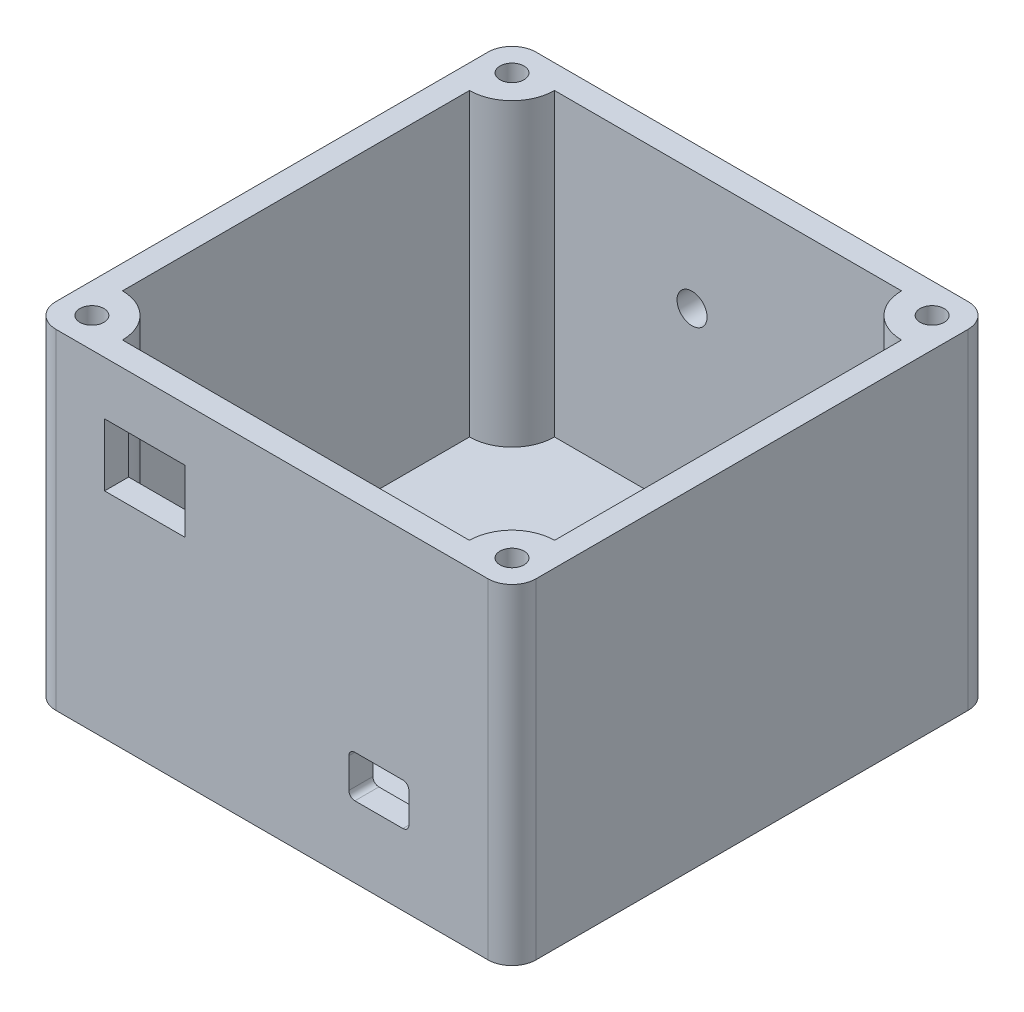
from build123d import *

# Parameters (mm, degrees)
BOSS_EXTRUDE1_DEPTH = 69.85
CUT_EXTRUDE1_START  = 69.85
CUT_EXTRUDE1_DEPTH  = 63.5
CUT_EXTRUDE2_START  = 69.85
SKETCH4_R           = 2.54
CUT_EXTRUDE2_DEPTH  = 5.08
SKETCH5_W           = 17.018
SKETCH5_H           = 13.208
CUT_EXTRUDE3_DEPTH  = 12.7
CUT_EXTRUDE4_DEPTH  = 12.7
SKETCH7_R           = 3.175
CUT_EXTRUDE5_DEPTH  = 7.62
SKETCH9_W           = 0.284935897
SKETCH9_H           = 2.320192307
SKETCH9_W_2         = 0.284935898
SKETCH9_H_2         = 2.320192308
CUT_EXTRUDE6_DEPTH  = 2.54


with BuildPart() as part:
    # Sketch3 → Boss-Extrude1 (new body)
    with BuildSketch(Plane(origin=(0, 0, 0), x_dir=(1, 0, 0), z_dir=(0, 1, 0))):
        with BuildLine():
            Line((-96.52, 0), (-5.08, 0))
            ThreePointArc((-5.08, 0), (-1.487897552, 1.487897552), (0, 5.08))
            Line((0, 5.08), (0, 96.52))
            ThreePointArc((0, 96.52), (-1.487897552, 100.112102448), (-5.08, 101.6))
            Line((-5.08, 101.6), (-96.52, 101.6))
            ThreePointArc((-96.52, 101.6), (-100.112102448, 100.112102448), (-101.6, 96.52))
            Line((-101.6, 96.52), (-101.6, 5.08))
            ThreePointArc((-101.6, 5.08), (-100.112102448, 1.487897552), (-96.52, 0))
        make_face()
    extrude(amount=BOSS_EXTRUDE1_DEPTH)

    # Sketch1 → Cut-Extrude1 (cut)
    with BuildSketch(Plane(origin=(0, 0, 0), x_dir=(1, 0, 0), z_dir=(0, 1, 0)).offset(CUT_EXTRUDE1_START)):
        with BuildLine():
            Line((-87.518767898, 5.08), (-14.081232102, 5.08))
            ThreePointArc((-14.081232102, 5.08), (-11.444832259, 11.444832259), (-5.08, 14.081232102))
            Line((-5.08, 14.081232102), (-5.08, 87.518767898))
            ThreePointArc((-5.08, 87.518767898), (-11.444832259, 90.155167741), (-14.081232102, 96.52))
            Line((-14.081232102, 96.52), (-87.518767898, 96.52))
            ThreePointArc((-87.518767898, 96.52), (-90.155167741, 90.155167741), (-96.52, 87.518767898))
            Line((-96.52, 87.518767898), (-96.52, 14.081232102))
            ThreePointArc((-96.52, 14.081232102), (-90.155167741, 11.444832259), (-87.518767898, 5.08))
        make_face()
    extrude(amount=-CUT_EXTRUDE1_DEPTH, mode=Mode.SUBTRACT)

    # Sketch4 → Cut-Extrude2 (cut)
    with BuildSketch(Plane(origin=(0, 0, 0), x_dir=(1, 0, 0), z_dir=(0, 1, 0)).offset(CUT_EXTRUDE2_START)):
        with Locations(Location((-95.25, 6.35, 0), (0, 0, 270))):
            Circle(SKETCH4_R)
        with Locations(Location((-6.35, 6.35, 0), (0, 0, 270))):
            Circle(SKETCH4_R)
        with Locations(Location((-6.35, 95.25, 0), (0, 0, 270))):
            Circle(SKETCH4_R)
        with Locations(Location((-95.25, 95.25, 0), (0, 0, 270))):
            Circle(SKETCH4_R)
    extrude(amount=-CUT_EXTRUDE2_DEPTH, mode=Mode.SUBTRACT)

    # Sketch5 → Cut-Extrude3 (cut)
    with BuildSketch(Plane.XY):
        with Locations((-77.701191891, 51.988881936)):
            Rectangle(SKETCH5_W, SKETCH5_H)
    extrude(amount=-CUT_EXTRUDE3_DEPTH, mode=Mode.SUBTRACT)

    # Sketch6 → Cut-Extrude4 (cut)
    with BuildSketch(Plane.XY):
        with BuildLine():
            Line((-33.252756043, 23.964278958), (-23.092756043, 23.964278958))
            ThreePointArc((-23.092756043, 23.964278958), (-22.194730431, 23.59230457), (-21.822756043, 22.694278958))
            Line((-21.822756043, 22.694278958), (-21.822756043, 16.344278958))
            ThreePointArc((-21.822756043, 16.344278958), (-22.194730431, 15.446253345), (-23.092756043, 15.074278958))
            Line((-23.092756043, 15.074278958), (-33.252756043, 15.074278958))
            ThreePointArc((-33.252756043, 15.074278958), (-34.150781655, 15.446253345), (-34.522756043, 16.344278958))
            Line((-34.522756043, 16.344278958), (-34.522756043, 22.694278958))
            ThreePointArc((-34.522756043, 22.694278958), (-34.150781655, 23.59230457), (-33.252756043, 23.964278958))
        make_face()
    extrude(amount=-CUT_EXTRUDE4_DEPTH, mode=Mode.SUBTRACT)

    # Sketch7 → Cut-Extrude5 (cut)
    with BuildSketch(Plane(origin=(0, 0, -101.6), x_dir=(-1, 0, 0), z_dir=(0, 0, -1))):
        with Locations((58.42, 44.45)):
            Circle(SKETCH7_R)
    extrude(amount=-CUT_EXTRUDE5_DEPTH, mode=Mode.SUBTRACT)

    # Sketch9 → Cut-Extrude6 (cut)
    # profile 1 of 29: a face of its own
    with BuildSketch(Plane.ZY.offset(101.6)):
        with BuildLine():
            Line((-90.26385309, 57.012643737), (-89.99545365, 57.173556197))
            add(Edge.make_bspline(
                [(-89.99545365, 57.173556197), (-89.970490678, 57.13176922), (-89.922662586, 57.051706983), (-89.842878139, 56.943522903), (-89.76020757, 56.851572947), (-89.674038674, 56.776392024), (-89.584897421, 56.717201963), (-89.492201887, 56.675289938), (-89.396264444, 56.649149732), (-89.330973906, 56.645974653), (-89.29837833, 56.644389531)],
                knots=[0, 0, 0, 0, 1.272034388, 2.437168799, 3.508375237, 4.49857839, 5.41946034, 6.295179144, 7.148887113, 8, 8, 8, 8], degree=3))
            add(Edge.make_bspline(
                [(-89.29837833, 56.644389531), (-89.270540964, 56.645164841), (-89.21535332, 56.646701895), (-89.134107571, 56.661470908), (-89.05520265, 56.684160482), (-88.980264814, 56.716655184), (-88.910328078, 56.755969382), (-88.848999147, 56.803454843), (-88.795980173, 56.856619044), (-88.752610477, 56.915930452), (-88.719336445, 56.979718151), (-88.693762211, 57.04519205), (-88.679569894, 57.11338068), (-88.677431982, 57.1592916), (-88.67635309, 57.182460444)],
                knots=[0, 0, 0, 0, 1.095163259, 2.171163733, 3.241058638, 4.321873601, 5.38011039, 6.391990106, 7.366004449, 8.327778327, 9.272591725, 10.192022065, 11.087607919, 12, 12, 12, 12], degree=3))
            add(Edge.make_bspline(
                [(-88.67635309, 57.182460444), (-88.6776905, 57.208895358), (-88.68040926, 57.262633674), (-88.703388531, 57.341917645), (-88.739537491, 57.420378762), (-88.77288646, 57.468912053), (-88.790200245, 57.494109082)],
                knots=[0, 0, 0, 0, 0.938893495, 1.908633276, 2.914225137, 4, 4, 4, 4], degree=3))
            add(Edge.make_bspline(
                [(-88.790200245, 57.494109082), (-88.804415731, 57.512294415), (-88.834259365, 57.550472246), (-88.885565108, 57.607300424), (-88.945768655, 57.665918562), (-89.012809737, 57.728564992), (-89.089130468, 57.792326064), (-89.172340427, 57.860242288), (-89.264564071, 57.929730861), (-89.3292429, 57.976333117), (-89.36261611, 58.000379114)],
                knots=[0, 0, 0, 0, 0.722233717, 1.516239348, 2.393582979, 3.351407094, 4.387010283, 5.505090956, 6.712668013, 8, 8, 8, 8], degree=3))
            add(Edge.make_bspline(
                [(-89.36261611, 58.000379114), (-89.396020736, 58.02417219), (-89.459887835, 58.069662739), (-89.549203835, 58.137176197), (-89.62907274, 58.198901707), (-89.699139563, 58.255420347), (-89.759373483, 58.306739781), (-89.810249148, 58.352367197), (-89.850470554, 58.39353657), (-89.872836688, 58.420244073), (-89.88287853, 58.432235084)],
                knots=[0, 0, 0, 0, 1.452282411, 2.77665338, 3.964542531, 5.026858415, 5.96415736, 6.766646006, 7.446254459, 8, 8, 8, 8], degree=3))
            add(Edge.make_bspline(
                [(-89.88287853, 58.432235084), (-89.896914339, 58.450923167), (-89.924517641, 58.487675791), (-89.960953946, 58.545120484), (-89.991923044, 58.603924446), (-90.016200302, 58.664245694), (-90.036643872, 58.72523738), (-90.050394281, 58.787695296), (-90.059004334, 58.851339185), (-90.059886064, 58.894168575), (-90.060327449, 58.915608481)],
                knots=[0, 0, 0, 0, 1.068054152, 2.10047183, 3.106115577, 4.101338837, 5.06977816, 6.043150881, 7.020423561, 8, 8, 8, 8], degree=3))
            add(Edge.make_bspline(
                [(-90.060327449, 58.915608481), (-90.059143438, 58.949199777), (-90.056800723, 59.015664377), (-90.036988254, 59.112756631), (-90.005716414, 59.205454309), (-89.961906052, 59.292839683), (-89.905429739, 59.372637394), (-89.840073748, 59.445765343), (-89.762230471, 59.507241129), (-89.676820591, 59.560954924), (-89.58333374, 59.602997299), (-89.485370563, 59.634711903), (-89.382775362, 59.65268173), (-89.313285375, 59.655260523), (-89.278025766, 59.656569018)],
                knots=[0, 0, 0, 0, 1.005424448, 1.989358655, 2.955360095, 3.929531133, 4.905563448, 5.876582895, 6.856512386, 7.866279853, 8.892233794, 9.918561126, 10.94386622, 12, 12, 12, 12], degree=3))
            add(Edge.make_bspline(
                [(-89.278025766, 59.656569018), (-89.240611475, 59.65527856), (-89.166206392, 59.652712252), (-89.056760317, 59.630398777), (-88.951385953, 59.593477454), (-88.866619563, 59.551577743), (-88.800277701, 59.509729958), (-88.749683865, 59.471611975), (-88.698414463, 59.427728841), (-88.646055942, 59.377963667), (-88.593495486, 59.321859829), (-88.539952783, 59.259801561), (-88.485302625, 59.192168114), (-88.450145524, 59.143885888), (-88.43212232, 59.119134122)],
                knots=[0, 0, 0, 0, 1.286793592, 2.559021753, 3.825965368, 5.121522368, 5.803751409, 6.523245864, 7.299691795, 8.125521123, 9.008227632, 9.944561021, 10.946284179, 12, 12, 12, 12], degree=3))
            Line((-88.43212232, 59.119134122), (-88.68970946, 58.92387671))
            add(Edge.make_bspline(
                [(-88.68970946, 58.92387671), (-88.70526327, 58.943914308), (-88.735216272, 58.982502036), (-88.780690878, 59.03654173), (-88.823552151, 59.08590525), (-88.865780014, 59.128781474), (-88.905144237, 59.167518409), (-88.943350411, 59.200683331), (-88.979848715, 59.228601193), (-89.025856198, 59.258394994), (-89.083657271, 59.287928393), (-89.156214672, 59.312919343), (-89.232039364, 59.327937149), (-89.283682673, 59.329922783), (-89.309826647, 59.330927992)],
                knots=[0, 0, 0, 0, 1.181633172, 2.275549214, 3.290209073, 4.226197932, 5.078386478, 5.862611352, 6.581680152, 7.217281963, 8.414376989, 9.595101626, 10.782541182, 12, 12, 12, 12], degree=3))
            add(Edge.make_bspline(
                [(-89.309826647, 59.330927992), (-89.342625778, 59.329828807), (-89.405875813, 59.327709133), (-89.495674098, 59.30455886), (-89.576495016, 59.268108173), (-89.645939129, 59.217022443), (-89.703757672, 59.156496971), (-89.74558191, 59.086847581), (-89.770755273, 59.00993783), (-89.773827113, 58.956287899), (-89.775391551, 58.928964851)],
                knots=[0, 0, 0, 0, 1.14458467, 2.207223713, 3.21896685, 4.227309161, 5.202851033, 6.127160689, 7.046193047, 8, 8, 8, 8], degree=3))
            add(Edge.make_bspline(
                [(-89.775391551, 58.928964851), (-89.775034929, 58.911954581), (-89.774321102, 58.877906227), (-89.764365393, 58.827603865), (-89.751575287, 58.777428579), (-89.731307328, 58.72760595), (-89.703326231, 58.677264639), (-89.66658225, 58.625537777), (-89.620305889, 58.571969441), (-89.584857456, 58.537128466), (-89.566141751, 58.518733481)],
                knots=[0, 0, 0, 0, 0.858281714, 1.717966888, 2.583508476, 3.4729293, 4.427298488, 5.488583878, 6.674047936, 8, 8, 8, 8], degree=3))
            add(Edge.make_bspline(
                [(-89.566141751, 58.518733481), (-89.559191792, 58.512531322), (-89.54268028, 58.497796412), (-89.512494262, 58.473673414), (-89.472631866, 58.443916613), (-89.424134012, 58.407098119), (-89.366106477, 58.364388507), (-89.298542879, 58.316333873), (-89.222196346, 58.261374207), (-89.168020037, 58.222949867), (-89.139373923, 58.20263272)],
                knots=[0, 0, 0, 0, 0.420754252, 0.999615792, 1.744751191, 2.668019286, 3.750313428, 4.999500688, 6.413464383, 8, 8, 8, 8], degree=3))
            add(Edge.make_bspline(
                [(-89.139373923, 58.20263272), (-89.104915273, 58.177558058), (-89.038190873, 58.129004451), (-88.943251497, 58.056055941), (-88.857169257, 57.984711179), (-88.779641922, 57.915425779), (-88.709903584, 57.848725294), (-88.648727937, 57.783807266), (-88.595491642, 57.721136783), (-88.538179065, 57.640788803), (-88.4796159, 57.54210882), (-88.429322533, 57.421206417), (-88.397610317, 57.299834041), (-88.3934633, 57.218257554), (-88.391417192, 57.178008321)],
                knots=[0, 0, 0, 0, 1.163667725, 2.253281268, 3.268753668, 4.215851969, 5.092017293, 5.902905408, 6.650798638, 7.335211899, 8.59617414, 9.77448103, 10.901945474, 12, 12, 12, 12], degree=3))
            add(Edge.make_bspline(
                [(-88.391417192, 57.178008321), (-88.39201331, 57.149543661), (-88.39319397, 57.093167106), (-88.406765656, 57.010385715), (-88.426649924, 56.929984854), (-88.456619415, 56.852958345), (-88.49319828, 56.777897025), (-88.539613376, 56.706769858), (-88.593413919, 56.638002625), (-88.655130263, 56.573429029), (-88.722663331, 56.514150694), (-88.794040683, 56.461419331), (-88.869379145, 56.417451638), (-88.948270018, 56.381573374), (-89.030731423, 56.353512255), (-89.116735627, 56.333180581), (-89.206424398, 56.320702186), (-89.267384835, 56.319407002), (-89.29837833, 56.318748505)],
                knots=[0, 0, 0, 0, 0.983748083, 1.948392443, 2.894712957, 3.844097841, 4.80183111, 5.778335162, 6.776009319, 7.81870978, 8.863265674, 9.881300176, 10.883814829, 11.87499822, 12.874611388, 13.892143829, 14.928324115, 16, 16, 16, 16], degree=3))
            add(Edge.make_bspline(
                [(-89.29837833, 56.318748505), (-89.322358963, 56.31921222), (-89.370018216, 56.320133809), (-89.440511818, 56.328281114), (-89.509581302, 56.339808272), (-89.576359972, 56.358109035), (-89.641708196, 56.38031315), (-89.705341758, 56.407652923), (-89.7672915, 56.440416385), (-89.827904593, 56.477876871), (-89.88702688, 56.521472111), (-89.944103826, 56.572248069), (-90.001008159, 56.628804348), (-90.056060297, 56.692676788), (-90.110373792, 56.762833477), (-90.162877778, 56.839930808), (-90.21465905, 56.923548836), (-90.247148796, 56.982390735), (-90.26385309, 57.012643737)],
                knots=[0, 0, 0, 0, 0.915332311, 1.819136955, 2.706846663, 3.586547465, 4.459518054, 5.340707479, 6.227863349, 7.133153174, 8.059268498, 9.028702269, 10.047606654, 11.120612155, 12.245963614, 13.433783089, 14.680604001, 16, 16, 16, 16], degree=3))
        make_face()
    # profile 2 of 29: a face of its own
    with BuildSketch(Plane.ZY.offset(101.6)):
        with BuildLine():
            add(Edge.make_bspline(
                [(-87.721054612, 59.697274146), (-87.703373204, 59.696453951), (-87.668749612, 59.694847851), (-87.618681433, 59.681094225), (-87.573091143, 59.657780939), (-87.532652772, 59.626502943), (-87.497952846, 59.589718805), (-87.473658916, 59.546846355), (-87.458044813, 59.500528875), (-87.456159267, 59.468220902), (-87.455199243, 59.451771342)],
                knots=[0, 0, 0, 0, 1.055194115, 2.066272739, 3.074728998, 4.095836921, 5.109056067, 6.073838105, 7.019297344, 8, 8, 8, 8], degree=3))
            add(Edge.make_bspline(
                [(-87.455199243, 59.451771342), (-87.456180917, 59.435748792), (-87.458121569, 59.404074108), (-87.473646855, 59.358559601), (-87.498159885, 59.316282858), (-87.532630521, 59.279570142), (-87.57309704, 59.248309437), (-87.618679867, 59.224991567), (-87.668750024, 59.211239156), (-87.703373343, 59.209632889), (-87.721054612, 59.208812608)],
                knots=[0, 0, 0, 0, 0.96129708, 1.900370562, 2.859976407, 3.87933698, 4.906634145, 5.921202961, 6.938410037, 8, 8, 8, 8], degree=3))
            add(Edge.make_bspline(
                [(-87.721054612, 59.208812608), (-87.73853369, 59.209601568), (-87.772554432, 59.211137177), (-87.821872925, 59.225261407), (-87.867074483, 59.248317416), (-87.907591722, 59.279365456), (-87.941364826, 59.316508327), (-87.965946878, 59.3585338), (-87.981436308, 59.404080676), (-87.983381792, 59.435750999), (-87.98436591, 59.451771342)],
                knots=[0, 0, 0, 0, 1.054934014, 2.053291228, 3.073705704, 4.106921865, 5.123545215, 6.088680038, 7.033164197, 8, 8, 8, 8], degree=3))
            add(Edge.make_bspline(
                [(-87.98436591, 59.451771342), (-87.983403353, 59.468218612), (-87.98151283, 59.50052209), (-87.965935267, 59.546872584), (-87.941569585, 59.589491518), (-87.907569359, 59.626707506), (-87.867080435, 59.657773008), (-87.821871387, 59.680824398), (-87.772554838, 59.694949828), (-87.738533828, 59.696485271), (-87.721054612, 59.697274146)],
                knots=[0, 0, 0, 0, 0.98631895, 1.937192651, 2.907499808, 3.917963147, 4.944918757, 5.95915025, 6.951458133, 8, 8, 8, 8], degree=3))
        make_face()
    # profile 3 of 29: a face of its own
    with BuildSketch(Plane.ZY.offset(101.6)):
        with Locations((-87.719782577, 57.560254916)):
            Rectangle(SKETCH9_W, SKETCH9_H)
    # profile 4 of 29: a face of its own
    with BuildSketch(Plane.ZY.offset(101.6)):
        Polygon((-86.600391551, 59.656569018), (-86.315455654, 59.656569018), (-86.315455654, 58.720351069), (-85.908404372, 58.720351069), (-85.908404372, 58.435415172), (-86.315455654, 58.435415172), (-86.315455654, 56.400158762), (-86.600391551, 56.400158762), (-86.600391551, 58.435415172), (-87.007442833, 58.435415172), (-87.007442833, 58.720351069), (-86.600391551, 58.720351069), align=None)
    # profile 5 of 29: a face of its own
    with BuildSketch(Plane.ZY.offset(101.6)):
        Polygon((-85.419942833, 59.656569018), (-85.135006936, 59.656569018), (-85.135006936, 57.773956838), (-84.079217673, 58.720351069), (-83.66962232, 58.720351069), (-84.894592272, 57.621312608), (-83.547506936, 56.400158762), (-83.956466271, 56.400158762), (-85.135006936, 57.469304395), (-85.135006936, 56.400158762), (-85.419942833, 56.400158762), align=None)
    # profile 6 of 29: a face of its own
    with BuildSketch(Plane.ZY.offset(101.6)):
        with BuildLine():
            Line((-80.860968474, 58.720351069), (-80.860968474, 56.400158762))
            Line((-80.860968474, 56.400158762), (-81.145904372, 56.400158762))
            Line((-81.145904372, 56.400158762), (-81.145904372, 56.801485885))
            add(Edge.make_bspline(
                [(-81.145904372, 56.801485885), (-81.178034275, 56.765164253), (-81.240736184, 56.694282132), (-81.34545777, 56.601679019), (-81.456463188, 56.525135827), (-81.573213672, 56.463314118), (-81.695603793, 56.41687561), (-81.823362244, 56.383868165), (-81.956541139, 56.362646615), (-82.047484347, 56.360527509), (-82.093570638, 56.359453633)],
                knots=[0, 0, 0, 0, 1.074387032, 2.096679803, 3.090159297, 4.057316773, 5.018401886, 5.985159533, 6.978961417, 8, 8, 8, 8], degree=3))
            add(Edge.make_bspline(
                [(-82.093570638, 56.359453633), (-82.134544424, 56.360566128), (-82.215346546, 56.362760017), (-82.334208637, 56.379780107), (-82.448592321, 56.407112885), (-82.558605683, 56.445122978), (-82.663536844, 56.495542723), (-82.764284217, 56.555905141), (-82.860325873, 56.627787894), (-82.950197912, 56.709964177), (-83.03295837, 56.799222487), (-83.105585381, 56.89442309), (-83.166139961, 56.995154323), (-83.216776748, 57.100140827), (-83.255780575, 57.210190789), (-83.282970943, 57.324923649), (-83.299971206, 57.444203748), (-83.302164188, 57.525428887), (-83.303276167, 57.566615092)],
                knots=[0, 0, 0, 0, 1.033919861, 2.038935746, 3.024066025, 3.998881131, 4.97069526, 5.957263378, 6.95902576, 7.993208707, 9.027059324, 10.027763471, 11.009749337, 11.988697705, 12.965288445, 13.950418724, 14.960734635, 16, 16, 16, 16], degree=3))
            add(Edge.make_bspline(
                [(-83.303276167, 57.566615092), (-83.302139542, 57.606950023), (-83.299892498, 57.686690006), (-83.283152791, 57.803964253), (-83.255003234, 57.916920104), (-83.215499115, 58.025193902), (-83.164842484, 58.128916662), (-83.103222005, 58.228161742), (-83.030633228, 58.323202553), (-82.946947116, 58.411804308), (-82.856292003, 58.493647294), (-82.759310511, 58.5647755), (-82.658415106, 58.626204355), (-82.552040804, 58.674875723), (-82.441762073, 58.714253982), (-82.326597161, 58.741498175), (-82.207025229, 58.757552173), (-82.125844568, 58.759876966), (-82.084666391, 58.761056197)],
                knots=[0, 0, 0, 0, 1.020392517, 2.01726096, 2.990465484, 3.961182959, 4.928053699, 5.906110375, 6.912531644, 7.948652711, 8.985773172, 9.998621852, 10.987621588, 11.969261332, 12.953316658, 13.946091881, 14.958173133, 16, 16, 16, 16], degree=3))
            add(Edge.make_bspline(
                [(-82.084666391, 58.761056197), (-82.037313662, 58.759751951), (-81.944457194, 58.757194386), (-81.8086325, 58.735910341), (-81.680140724, 58.699952589), (-81.55798999, 58.651041715), (-81.442618939, 58.586046083), (-81.335119803, 58.504058547), (-81.234367544, 58.405596184), (-81.175965422, 58.329967281), (-81.145904372, 58.29103917)],
                knots=[0, 0, 0, 0, 1.038897134, 2.037228247, 3.008116434, 3.962042015, 4.918381754, 5.904844433, 6.921570401, 8, 8, 8, 8], degree=3))
            Line((-81.145904372, 58.29103917), (-81.145904372, 58.720351069))
            Line((-81.145904372, 58.720351069), (-80.860968474, 58.720351069))
        make_face()
        with BuildLine():
            add(Edge.make_bspline(
                [(-82.080850285, 58.4761203), (-82.122501149, 58.474638357), (-82.204713329, 58.471713238), (-82.325403245, 58.448877281), (-82.440894699, 58.410881971), (-82.550610066, 58.358919103), (-82.652816234, 58.293578749), (-82.744159779, 58.214547209), (-82.825387801, 58.123980775), (-82.893703155, 58.022288146), (-82.949393105, 57.913269449), (-82.98855177, 57.799310137), (-83.014377444, 57.682465622), (-83.017015888, 57.603215186), (-83.018340269, 57.563435003)],
                knots=[0, 0, 0, 0, 1.031046209, 2.035121221, 3.029706178, 4.034933723, 5.034054252, 6.02443088, 7.017295772, 8.038157696, 9.050218397, 10.03989886, 11.016116709, 12, 12, 12, 12], degree=3))
            add(Edge.make_bspline(
                [(-83.018340269, 57.563435003), (-83.016648544, 57.523892549), (-83.013271726, 57.444962633), (-82.989005025, 57.327958825), (-82.948292568, 57.213972658), (-82.892737268, 57.103971614), (-82.823171545, 57.001841751), (-82.742536838, 56.909548926), (-82.650053369, 56.830183371), (-82.547611987, 56.763746429), (-82.438203329, 56.710077571), (-82.323146834, 56.672734455), (-82.204605362, 56.648624611), (-82.124003602, 56.645808407), (-82.083394356, 56.644389531)],
                knots=[0, 0, 0, 0, 0.979072187, 1.954306742, 2.945804271, 3.96968567, 4.997920485, 5.998718438, 6.996577872, 8.005894225, 9.015743152, 10.005417472, 10.995077863, 12, 12, 12, 12], degree=3))
            add(Edge.make_bspline(
                [(-82.083394356, 56.644389531), (-82.042167885, 56.645895355), (-81.960172525, 56.648890291), (-81.839124554, 56.67182401), (-81.721654123, 56.709714277), (-81.609361423, 56.762237056), (-81.504753219, 56.827331229), (-81.410865858, 56.903537662), (-81.331476373, 56.992168407), (-81.264173077, 57.08957419), (-81.211399663, 57.196355786), (-81.172958524, 57.310051802), (-81.150231052, 57.430666195), (-81.14736654, 57.513092758), (-81.145904372, 57.555166774)],
                knots=[0, 0, 0, 0, 1.01762866, 2.023962475, 3.030623092, 4.058876274, 5.077231937, 6.066672613, 7.034107872, 8.005628644, 8.981990164, 9.965428785, 10.961468474, 12, 12, 12, 12], degree=3))
            add(Edge.make_bspline(
                [(-81.145904372, 57.555166774), (-81.146774917, 57.587223235), (-81.148488426, 57.650320494), (-81.161579014, 57.742964742), (-81.182402412, 57.831623193), (-81.211745009, 57.916389061), (-81.250290674, 57.996793682), (-81.296779719, 58.073414379), (-81.352029662, 58.145852649), (-81.415151108, 58.213111007), (-81.484243827, 58.274457869), (-81.557354589, 58.329216859), (-81.635349595, 58.37420096), (-81.716917193, 58.411431256), (-81.802198904, 58.44105777), (-81.89188868, 58.460822321), (-81.98503319, 58.47439347), (-82.048574969, 58.475538629), (-82.080850285, 58.4761203)],
                knots=[0, 0, 0, 0, 1.050140795, 2.067009409, 3.05949893, 4.030605086, 5.00011959, 5.97591094, 6.962425594, 7.979863591, 8.993523472, 9.986985069, 10.967611495, 11.937549037, 12.921786183, 13.919465291, 14.943216303, 16, 16, 16, 16], degree=3))
        make_face(mode=Mode.SUBTRACT)
    # profile 7 of 29: a face of its own
    with BuildSketch(Plane.ZY.offset(101.6)):
        Polygon((-80.128276167, 56.400158762), (-80.128276167, 59.575158762), (-80.068490509, 59.575158762), (-77.970904372, 57.0762455), (-77.970904372, 59.575158762), (-77.685968474, 59.575158762), (-77.685968474, 56.400158762), (-77.750842272, 56.400158762), (-79.843340269, 58.893347864), (-79.843340269, 56.400158762), align=None)
    # profile 8 of 29: a face of its own
    with BuildSketch(Plane.ZY.offset(101.6)):
        with BuildLine():
            Line((-75.049039388, 57.132851069), (-74.795904372, 56.999923385))
            add(Edge.make_bspline(
                [(-74.795904372, 56.999923385), (-74.81607614, 56.964142649), (-74.855322414, 56.894527505), (-74.922814521, 56.798885746), (-74.993564472, 56.712845318), (-75.070765929, 56.638704846), (-75.152109138, 56.574069661), (-75.238045189, 56.517520349), (-75.329021473, 56.469334263), (-75.425042295, 56.428737327), (-75.526914031, 56.397523), (-75.634883549, 56.375475599), (-75.749157692, 56.361847348), (-75.827486012, 56.360264257), (-75.867594075, 56.359453633)],
                knots=[0, 0, 0, 0, 1.120438281, 2.179929193, 3.190490725, 4.156257408, 5.095198341, 6.022838206, 6.959905092, 7.901321166, 8.864066838, 9.862729781, 10.905609505, 12, 12, 12, 12], degree=3))
            add(Edge.make_bspline(
                [(-75.867594075, 56.359453633), (-75.912172869, 56.360494285), (-75.999133181, 56.362524296), (-76.125715666, 56.380025317), (-76.244895567, 56.408575242), (-76.356666184, 56.448458269), (-76.460753799, 56.500553056), (-76.557365288, 56.5640163), (-76.647008716, 56.638521988), (-76.726859248, 56.724715476), (-76.79874477, 56.816955538), (-76.862177478, 56.913072662), (-76.915206719, 57.012825015), (-76.95834373, 57.115577562), (-76.993182429, 57.220682665), (-77.017463653, 57.32909664), (-77.031460639, 57.440526062), (-77.033605529, 57.515907217), (-77.034686423, 57.553894739)],
                knots=[0, 0, 0, 0, 1.145258523, 2.234067595, 3.276747158, 4.290159414, 5.277019952, 6.260822364, 7.254936242, 8.264827045, 9.274100331, 10.257902744, 11.220704747, 12.172965371, 13.118907548, 14.062713208, 15.023725156, 16, 16, 16, 16], degree=3))
            add(Edge.make_bspline(
                [(-77.034686423, 57.553894739), (-77.03372563, 57.589540764), (-77.031821467, 57.660186477), (-77.019819252, 57.764748793), (-76.998548301, 57.866374603), (-76.969359778, 57.965148353), (-76.931666862, 58.06090466), (-76.885554778, 58.153701803), (-76.830951692, 58.243441037), (-76.788794338, 58.300049594), (-76.767559019, 58.32856421)],
                knots=[0, 0, 0, 0, 1.024358464, 2.0301432, 3.019427413, 4.004406732, 4.986367066, 5.972626655, 6.978780325, 8, 8, 8, 8], degree=3))
            add(Edge.make_bspline(
                [(-76.767559019, 58.32856421), (-76.738795621, 58.362916685), (-76.682179977, 58.430533436), (-76.586425283, 58.519377489), (-76.482738676, 58.593802913), (-76.372419558, 58.655495101), (-76.254185757, 58.702370481), (-76.129626614, 58.737302359), (-75.997323832, 58.756876698), (-75.906876954, 58.759641518), (-75.860597881, 58.761056197)],
                knots=[0, 0, 0, 0, 1.030682036, 2.02871468, 2.997146059, 3.962720338, 4.930598197, 5.918074684, 6.934738563, 8, 8, 8, 8], degree=3))
            add(Edge.make_bspline(
                [(-75.860597881, 58.761056197), (-75.813020411, 58.759827882), (-75.719684259, 58.757418206), (-75.583583692, 58.735078604), (-75.454805042, 58.699652358), (-75.333399842, 58.649619991), (-75.219355782, 58.585068111), (-75.113414152, 58.50511087), (-75.013763137, 58.412203033), (-74.955788926, 58.34075355), (-74.926287985, 58.30439554)],
                knots=[0, 0, 0, 0, 1.056321875, 2.072262726, 3.055038591, 4.01806755, 4.982017516, 5.957941055, 6.960871419, 8, 8, 8, 8], degree=3))
            add(Edge.make_bspline(
                [(-74.926287985, 58.30439554), (-74.906215691, 58.276996577), (-74.866204711, 58.222381027), (-74.816087698, 58.133325763), (-74.77258349, 58.040152581), (-74.737810018, 57.941355383), (-74.709652756, 57.838104764), (-74.689281214, 57.729662598), (-74.677334488, 57.616061178), (-74.67498617, 57.538657803), (-74.673788987, 57.499197223)],
                knots=[0, 0, 0, 0, 0.94817472, 1.890038105, 2.849395472, 3.817997239, 4.812318967, 5.836947057, 6.897266129, 8, 8, 8, 8], degree=3))
            Line((-74.673788987, 57.499197223), (-76.749750525, 57.499197223))
            add(Edge.make_bspline(
                [(-76.749750525, 57.499197223), (-76.748353883, 57.468626088), (-76.74560744, 57.408509183), (-76.732802989, 57.32054283), (-76.712620173, 57.236747012), (-76.684254666, 57.157750253), (-76.649904028, 57.08252078), (-76.607825556, 57.011616646), (-76.557624675, 56.94536081), (-76.501630648, 56.883160621), (-76.439303497, 56.827769787), (-76.373732719, 56.778192819), (-76.303979271, 56.736640599), (-76.230593152, 56.702913127), (-76.153693033, 56.676509541), (-76.073254685, 56.658486589), (-75.989436393, 56.646415142), (-75.932299335, 56.645072874), (-75.903211062, 56.644389531)],
                knots=[0, 0, 0, 0, 1.094153842, 2.151609401, 3.174256925, 4.172055639, 5.149267565, 6.128595816, 7.11444997, 8.118368179, 9.117203808, 10.09244225, 11.054858984, 12.015122123, 12.976791628, 13.957293641, 14.960065497, 16, 16, 16, 16], degree=3))
            add(Edge.make_bspline(
                [(-75.903211062, 56.644389531), (-75.874771093, 56.644941125), (-75.818340737, 56.646035594), (-75.734302245, 56.656678113), (-75.651625674, 56.673886863), (-75.570653211, 56.697372783), (-75.493028229, 56.726017498), (-75.421141194, 56.760582234), (-75.355028427, 56.798818075), (-75.293236608, 56.842551138), (-75.233300778, 56.896079993), (-75.17384438, 56.962878111), (-75.110093415, 57.04187894), (-75.070188571, 57.101338223), (-75.049039388, 57.132851069)],
                knots=[0, 0, 0, 0, 0.99110716, 1.966546729, 2.947904876, 3.932708344, 4.903319531, 5.828989031, 6.710028674, 7.56322171, 8.463672341, 9.504779593, 10.677557249, 12, 12, 12, 12], degree=3))
        make_face()
        with BuildLine():
            add(Edge.make_bspline(
                [(-74.958724884, 57.78413312), (-74.969153965, 57.821927299), (-74.989226589, 57.894668926), (-75.031169577, 57.995398877), (-75.078405903, 58.084922901), (-75.134305616, 58.162555854), (-75.197641174, 58.231501898), (-75.270797876, 58.291753043), (-75.352836151, 58.345653159), (-75.443331943, 58.391148641), (-75.539164133, 58.429874441), (-75.63949975, 58.455841511), (-75.741877886, 58.473630167), (-75.811123989, 58.475286708), (-75.845969476, 58.4761203)],
                knots=[0, 0, 0, 0, 1.154881502, 2.222775134, 3.210006277, 4.132804581, 5.035138423, 5.962687519, 6.919655026, 7.923214229, 8.944639381, 9.960483929, 10.97369054, 12, 12, 12, 12], degree=3))
            add(Edge.make_bspline(
                [(-75.845969476, 58.4761203), (-75.874407895, 58.475565426), (-75.930624671, 58.474468558), (-76.013447783, 58.464063512), (-76.092985795, 58.446864225), (-76.169825592, 58.4233103), (-76.242960237, 58.391915353), (-76.313894062, 58.355100569), (-76.380823422, 58.310159275), (-76.422680168, 58.2759066), (-76.443826046, 58.258602271)],
                knots=[0, 0, 0, 0, 1.04873581, 2.073130211, 3.073294108, 4.04793562, 5.032784715, 6.005352987, 6.992311501, 8, 8, 8, 8], degree=3))
            add(Edge.make_bspline(
                [(-76.443826046, 58.258602271), (-76.458969238, 58.244909571), (-76.489615367, 58.217198882), (-76.530564268, 58.169456673), (-76.569771411, 58.117974899), (-76.605452654, 58.060783964), (-76.638180178, 57.998535115), (-76.668805301, 57.931753403), (-76.696370117, 57.859932063), (-76.711878731, 57.809882779), (-76.719857697, 57.78413312)],
                knots=[0, 0, 0, 0, 0.879870761, 1.780643979, 2.707998968, 3.669668524, 4.684282772, 5.740141944, 6.837334558, 8, 8, 8, 8], degree=3))
            Line((-76.719857697, 57.78413312), (-74.958724884, 57.78413312))
        make_face(mode=Mode.SUBTRACT)
    # profile 9 of 29: a face of its own
    with BuildSketch(Plane.ZY.offset(101.6)):
        Polygon((-73.818981295, 59.656569018), (-73.534045397, 59.656569018), (-73.534045397, 58.720351069), (-73.126994115, 58.720351069), (-73.126994115, 58.435415172), (-73.534045397, 58.435415172), (-73.534045397, 56.400158762), (-73.818981295, 56.400158762), (-73.818981295, 58.435415172), (-74.226032577, 58.435415172), (-74.226032577, 58.720351069), (-73.818981295, 58.720351069), align=None)
    # profile 10 of 29: a face of its own
    with BuildSketch(Plane.ZY.offset(101.6)):
        Polygon((-71.335968474, 59.575158762), (-71.051032577, 59.575158762), (-71.051032577, 58.272594659), (-69.422827449, 58.272594659), (-69.422827449, 59.575158762), (-69.137891551, 59.575158762), (-69.137891551, 56.400158762), (-69.422827449, 56.400158762), (-69.422827449, 57.946953633), (-71.051032577, 57.946953633), (-71.051032577, 56.400158762), (-71.335968474, 56.400158762), align=None)
    # profile 11 of 29: a face of its own
    with BuildSketch(Plane.ZY.offset(101.6)):
        with BuildLine():
            Line((-68.445904372, 58.720351069), (-68.160968474, 58.720351069))
            Line((-68.160968474, 58.720351069), (-68.160968474, 57.644209242))
            add(Edge.make_bspline(
                [(-68.160968474, 57.644209242), (-68.160839746, 57.612620034), (-68.160593496, 57.552191359), (-68.158923499, 57.465237011), (-68.154995486, 57.385937564), (-68.150084373, 57.31424721), (-68.143768721, 57.250178076), (-68.13625453, 57.193953945), (-68.127855819, 57.144937221), (-68.119634643, 57.115415748), (-68.115811223, 57.101686205)],
                knots=[0, 0, 0, 0, 1.388932606, 2.656963016, 3.823490214, 4.879454478, 5.816252168, 6.653371382, 7.373723809, 8, 8, 8, 8], degree=3))
            add(Edge.make_bspline(
                [(-68.115811223, 57.101686205), (-68.109677617, 57.084429744), (-68.097537922, 57.050275578), (-68.075518405, 57.000936981), (-68.048278413, 56.955239403), (-68.018469855, 56.911420709), (-67.984089678, 56.870778906), (-67.945572872, 56.833382628), (-67.904208757, 56.797818917), (-67.842745272, 56.755741284), (-67.758690081, 56.710642377), (-67.648333653, 56.671729742), (-67.528677676, 56.648474391), (-67.445978252, 56.645776317), (-67.403471479, 56.644389531)],
                knots=[0, 0, 0, 0, 0.725840625, 1.436591201, 2.137033971, 2.831655856, 3.53531722, 4.242432219, 4.957935707, 5.694543706, 7.190802206, 8.724350549, 10.316345118, 12, 12, 12, 12], degree=3))
            add(Edge.make_bspline(
                [(-67.403471479, 56.644389531), (-67.360968654, 56.645805806), (-67.278733552, 56.648546037), (-67.160392259, 56.671028247), (-67.05221419, 56.708589122), (-66.955285113, 56.761028703), (-66.870044672, 56.82520186), (-66.799011378, 56.900502708), (-66.740403368, 56.984548938), (-66.714813394, 57.047254533), (-66.701944035, 57.078789571)],
                knots=[0, 0, 0, 0, 1.157059328, 2.238695713, 3.266970494, 4.264342957, 5.228770407, 6.160125903, 7.074715775, 8, 8, 8, 8], degree=3))
            add(Edge.make_bspline(
                [(-66.701944035, 57.078789571), (-66.698139269, 57.091458999), (-66.689727861, 57.11946801), (-66.680690585, 57.166983925), (-66.672549466, 57.223648245), (-66.665597871, 57.289831762), (-66.660640188, 57.365361522), (-66.657967721, 57.45021392), (-66.6549485, 57.544122582), (-66.654902674, 57.609861193), (-66.654878731, 57.644209242)],
                knots=[0, 0, 0, 0, 0.557542046, 1.232589297, 2.036731608, 2.971723315, 4.038036528, 5.22795436, 6.551621927, 8, 8, 8, 8], degree=3))
            Line((-66.654878731, 57.644209242), (-66.654878731, 58.720351069))
            Line((-66.654878731, 58.720351069), (-66.369942833, 58.720351069))
            Line((-66.369942833, 58.720351069), (-66.369942833, 57.590783762))
            add(Edge.make_bspline(
                [(-66.369942833, 57.590783762), (-66.370343513, 57.552405113), (-66.371120888, 57.477945285), (-66.376116835, 57.369737556), (-66.384688984, 57.268897519), (-66.397699848, 57.175371798), (-66.412999424, 57.089231797), (-66.432735472, 57.010367114), (-66.456301445, 56.939020733), (-66.482885733, 56.873940692), (-66.514292713, 56.814933867), (-66.547700082, 56.758930662), (-66.586276125, 56.707320642), (-66.626889123, 56.657534703), (-66.67206634, 56.612049175), (-66.720961212, 56.569820336), (-66.772885542, 56.530202657), (-66.828991601, 56.494741282), (-66.888460315, 56.462794754), (-66.951365099, 56.434477312), (-67.018476434, 56.412068545), (-67.088928447, 56.392736727), (-67.163066311, 56.377574316), (-67.240818553, 56.366882216), (-67.322158984, 56.360327809), (-67.377593994, 56.359749918), (-67.40601555, 56.359453633)],
                knots=[0, 0, 0, 0, 1.493040784, 2.896703357, 4.213163133, 5.428574705, 6.569057535, 7.615249723, 8.588095153, 9.490268104, 10.346124644, 11.18633936, 12.024365274, 12.850166724, 13.684164916, 14.514361689, 15.362232829, 16.222528818, 17.093394965, 17.986930858, 18.902426812, 19.842810585, 20.827885679, 21.843828298, 22.894529745, 24, 24, 24, 24], degree=3))
            add(Edge.make_bspline(
                [(-67.40601555, 56.359453633), (-67.43422453, 56.359761796), (-67.489657803, 56.360367365), (-67.571002432, 56.366846005), (-67.648970096, 56.377557703), (-67.723283601, 56.392847793), (-67.794017518, 56.411933235), (-67.861458364, 56.434615013), (-67.924816454, 56.46280945), (-67.984852986, 56.494539092), (-68.041098009, 56.530430449), (-68.093810791, 56.569771456), (-68.14292065, 56.612503385), (-68.188438419, 56.658447773), (-68.22972519, 56.708174565), (-68.267295457, 56.761283752), (-68.301727611, 56.817249104), (-68.332890499, 56.87717783), (-68.359661877, 56.94301101), (-68.383297708, 57.015851948), (-68.402629501, 57.096499231), (-68.418361597, 57.184883909), (-68.431017547, 57.280582983), (-68.439804262, 57.384150045), (-68.444717194, 57.495332823), (-68.445500114, 57.572122366), (-68.445904372, 57.611772343)],
                knots=[0, 0, 0, 0, 1.083640291, 2.129454052, 3.13281866, 4.105697902, 5.042300162, 5.946461698, 6.836384745, 7.703652036, 8.553297018, 9.397182691, 10.228592656, 11.052265423, 11.879314572, 12.708807002, 13.549817954, 14.402308542, 15.300838682, 16.27712199, 17.341985831, 18.484375296, 19.725102775, 21.0496083, 22.476576903, 24, 24, 24, 24], degree=3))
            Line((-68.445904372, 57.611772343), (-68.445904372, 58.720351069))
        make_face()
    # profile 12 of 29: a face of its own
    with BuildSketch(Plane.ZY.offset(101.6)):
        with BuildLine():
            Line((-65.718660782, 56.400158762), (-65.718660782, 59.656569018))
            Line((-65.718660782, 59.656569018), (-65.433724884, 59.656569018))
            Line((-65.433724884, 59.656569018), (-65.433724884, 58.299307399))
            add(Edge.make_bspline(
                [(-65.433724884, 58.299307399), (-65.401617997, 58.336280666), (-65.338976137, 58.408417034), (-65.233950356, 58.502621688), (-65.123818161, 58.582497863), (-65.007741743, 58.648343842), (-64.885556011, 58.6984849), (-64.757891884, 58.735153782), (-64.624423011, 58.757276187), (-64.533419189, 58.759785411), (-64.487330654, 58.761056197)],
                knots=[0, 0, 0, 0, 1.077089805, 2.101446609, 3.097517232, 4.067117542, 5.031729543, 5.997785507, 6.985986182, 8, 8, 8, 8], degree=3))
            add(Edge.make_bspline(
                [(-64.487330654, 58.761056197), (-64.446358514, 58.759931133), (-64.365349612, 58.75770669), (-64.24625795, 58.74080254), (-64.131673765, 58.713390677), (-64.021659427, 58.675388486), (-63.916728278, 58.624966785), (-63.815981848, 58.564604313), (-63.719936298, 58.492723829), (-63.630079366, 58.410538218), (-63.547262769, 58.321314711), (-63.474770707, 58.225901139), (-63.413538839, 58.12568445), (-63.362891881, 58.021000107), (-63.323729569, 57.91142056), (-63.296749083, 57.797053251), (-63.279610012, 57.678010692), (-63.277450789, 57.59699122), (-63.27635309, 57.555802792)],
                knots=[0, 0, 0, 0, 1.034377878, 2.045141349, 3.03070803, 4.00595497, 4.978199603, 5.965204761, 6.967410914, 8.002051993, 9.036360596, 10.037508045, 11.022711142, 11.997267194, 12.969246472, 13.954813154, 14.960274251, 16, 16, 16, 16], degree=3))
            add(Edge.make_bspline(
                [(-63.27635309, 57.555802792), (-63.277474718, 57.51525349), (-63.279686392, 57.435296653), (-63.296578579, 57.317634277), (-63.324469833, 57.204387743), (-63.364348906, 57.095849681), (-63.414482101, 56.991510188), (-63.477175901, 56.892558679), (-63.549575879, 56.797273322), (-63.633333421, 56.708714742), (-63.723969287, 56.626860158), (-63.820955778, 56.555734837), (-63.92184995, 56.494305735), (-64.028224345, 56.445632579), (-64.138503925, 56.406261744), (-64.253870169, 56.378940696), (-64.373670383, 56.362999424), (-64.455058232, 56.360644874), (-64.4962349, 56.359453633)],
                knots=[0, 0, 0, 0, 1.024244038, 2.01964794, 2.996620209, 3.965911562, 4.936179293, 5.91563013, 6.920572822, 7.955171681, 8.990768464, 10.002129126, 10.989675881, 11.969873457, 12.952483066, 13.943799762, 14.959703725, 16, 16, 16, 16], degree=3))
            add(Edge.make_bspline(
                [(-64.4962349, 56.359453633), (-64.543374681, 56.360760471), (-64.635807571, 56.363322951), (-64.771019631, 56.384567311), (-64.899000751, 56.420727486), (-65.021208813, 56.46931565), (-65.135896819, 56.5351095), (-65.243792919, 56.616713124), (-65.344216693, 56.715471169), (-65.403377661, 56.790819806), (-65.433724884, 56.829470661)],
                knots=[0, 0, 0, 0, 1.035807596, 2.031038093, 2.998900396, 3.954262848, 4.914341711, 5.895762244, 6.92060972, 8, 8, 8, 8], degree=3))
            Line((-65.433724884, 56.829470661), (-65.433724884, 56.400158762))
            Line((-65.433724884, 56.400158762), (-65.718660782, 56.400158762))
        make_face()
        with BuildLine():
            add(Edge.make_bspline(
                [(-64.498778971, 56.644389531), (-64.457128094, 56.645871466), (-64.374915888, 56.648796569), (-64.254226164, 56.671632641), (-64.138733988, 56.709627516), (-64.029021335, 56.761592023), (-63.926805102, 56.826926297), (-63.835498784, 56.905980324), (-63.754327904, 56.996242412), (-63.686608079, 57.098054405), (-63.630069272, 57.206413498), (-63.591231514, 57.3203999), (-63.565178624, 57.436963031), (-63.562591182, 57.516016942), (-63.561288987, 57.555802792)],
                knots=[0, 0, 0, 0, 1.031910345, 2.036826888, 3.032245421, 4.038315463, 5.03827337, 6.029480047, 7.023177075, 8.037597977, 9.052889626, 10.043399556, 11.015292101, 12, 12, 12, 12], degree=3))
            add(Edge.make_bspline(
                [(-63.561288987, 57.555802792), (-63.56300144, 57.595549748), (-63.566419511, 57.674884979), (-63.590345206, 57.792495749), (-63.632126201, 57.906421666), (-63.68756898, 58.016347412), (-63.756392081, 58.118861631), (-63.837133205, 58.210927675), (-63.929554557, 58.29035709), (-64.031901516, 58.356569511), (-64.140922118, 58.410598534), (-64.255667193, 58.447650807), (-64.373739204, 58.471906163), (-64.453926544, 58.474708444), (-64.494326848, 58.4761203)],
                knots=[0, 0, 0, 0, 0.984795267, 1.965658976, 2.959410029, 3.983795688, 5.009594896, 6.01088574, 7.009236619, 8.019050059, 9.024672985, 10.014834719, 10.999826153, 12, 12, 12, 12], degree=3))
            add(Edge.make_bspline(
                [(-64.494326848, 58.4761203), (-64.535572372, 58.474709242), (-64.617436369, 58.471908577), (-64.738238971, 58.447608194), (-64.85622495, 58.410372146), (-64.968971497, 58.356912994), (-65.074067676, 58.291497597), (-65.168059117, 58.214626131), (-65.249095601, 58.126832928), (-65.315810307, 58.028402665), (-65.368791804, 57.922099097), (-65.406695632, 57.80869517), (-65.429373883, 57.688787837), (-65.432256903, 57.606570571), (-65.433724884, 57.564707039)],
                knots=[0, 0, 0, 0, 1.016820015, 2.018181405, 3.029022337, 4.06341356, 5.088169224, 6.076823655, 7.05054209, 8.02560866, 9.001194327, 9.972267242, 10.967515442, 12, 12, 12, 12], degree=3))
            add(Edge.make_bspline(
                [(-65.433724884, 57.564707039), (-65.432854326, 57.532650589), (-65.431140792, 57.469553352), (-65.418050386, 57.376908947), (-65.397226322, 57.28825107), (-65.367886152, 57.20348311), (-65.329331461, 57.123086268), (-65.282876434, 57.046436253), (-65.227584583, 56.974224708), (-65.165076463, 56.906628667), (-65.096167732, 56.845115841), (-65.022214617, 56.791795594), (-64.944728351, 56.745881293), (-64.862822449, 56.709282757), (-64.777450064, 56.679413699), (-64.68773514, 56.659698087), (-64.594597491, 56.646113588), (-64.531054767, 56.644970267), (-64.498778971, 56.644389531)],
                knots=[0, 0, 0, 0, 1.050331198, 2.067384183, 3.060053655, 4.031335885, 5.001026174, 5.976994447, 6.963687968, 7.976578778, 8.990422448, 9.985569286, 10.960374351, 11.936812464, 12.921228065, 13.919088064, 14.943024695, 16, 16, 16, 16], degree=3))
        make_face(mode=Mode.SUBTRACT)
    # profile 13 of 29: a face of its own
    with BuildSketch(Plane.ZY.offset(101.6)):
        with BuildLine():
            Line((-89.938212064, 53.283492095), (-89.653276167, 53.283492095))
            Line((-89.653276167, 53.283492095), (-89.653276167, 51.381163369))
            add(Edge.make_bspline(
                [(-89.653276167, 51.381163369), (-89.65331857, 51.354238701), (-89.653399038, 51.303144505), (-89.652861543, 51.230420404), (-89.651356259, 51.165766102), (-89.650407243, 51.108932379), (-89.648296019, 51.06018003), (-89.646574219, 51.019244927), (-89.644360285, 50.9863209), (-89.641699529, 50.967106774), (-89.640555814, 50.958847664)],
                knots=[0, 0, 0, 0, 1.528628734, 2.90083645, 4.128790002, 5.200304208, 6.127813768, 6.898992206, 7.526736466, 8, 8, 8, 8], degree=3))
            add(Edge.make_bspline(
                [(-89.640555814, 50.958847664), (-89.635859119, 50.929050957), (-89.626730372, 50.871136481), (-89.603465443, 50.788669683), (-89.570973853, 50.714346146), (-89.53247195, 50.645846617), (-89.481733081, 50.585077698), (-89.420951303, 50.529096413), (-89.34731147, 50.480136276), (-89.265432206, 50.435368039), (-89.177180598, 50.399386143), (-89.087000378, 50.372177877), (-88.996247104, 50.355596303), (-88.935490154, 50.3536763), (-88.905319436, 50.352722864)],
                knots=[0, 0, 0, 0, 1.035780045, 2.013197591, 2.933192213, 3.817615948, 4.702609284, 5.640816605, 6.646850145, 7.73207398, 8.84249596, 9.914020372, 10.964143139, 12, 12, 12, 12], degree=3))
            add(Edge.make_bspline(
                [(-88.905319436, 50.352722864), (-88.879417114, 50.353697), (-88.827762076, 50.355639645), (-88.751011957, 50.367669657), (-88.676263287, 50.389350884), (-88.603146955, 50.417326951), (-88.53461142, 50.454290837), (-88.47061844, 50.496990813), (-88.413501157, 50.547074965), (-88.361378545, 50.602501706), (-88.31598971, 50.665039953), (-88.276645889, 50.733327978), (-88.244418795, 50.808393457), (-88.228504312, 50.861147826), (-88.22032845, 50.888249707)],
                knots=[0, 0, 0, 0, 0.994687771, 1.983630487, 2.973142513, 3.978332533, 4.983357753, 5.956394766, 6.925816176, 7.893390482, 8.871859704, 9.88551698, 10.913711441, 12, 12, 12, 12], degree=3))
            add(Edge.make_bspline(
                [(-88.22032845, 50.888249707), (-88.217606908, 50.899451628), (-88.211542215, 50.924414022), (-88.205875253, 50.966615479), (-88.199972905, 51.016407973), (-88.195877545, 51.074149261), (-88.191885009, 51.139645857), (-88.189496436, 51.213238962), (-88.188392413, 51.294661348), (-88.18806341, 51.351482202), (-88.187891551, 51.381163369)],
                knots=[0, 0, 0, 0, 0.558680831, 1.244966039, 2.062412453, 2.990489873, 4.051219941, 5.244515665, 6.560634259, 8, 8, 8, 8], degree=3))
            Line((-88.187891551, 51.381163369), (-88.187891551, 53.283492095))
            Line((-88.187891551, 53.283492095), (-87.902955654, 53.283492095))
            Line((-87.902955654, 53.283492095), (-87.902955654, 51.365898946))
            add(Edge.make_bspline(
                [(-87.902955654, 51.365898946), (-87.903186177, 51.331338273), (-87.903636058, 51.26389102), (-87.907537295, 51.165056573), (-87.913757573, 51.071300654), (-87.922546053, 50.982610661), (-87.934191049, 50.899303959), (-87.947140713, 50.820650348), (-87.963632147, 50.747214419), (-87.982893875, 50.678423583), (-88.004913451, 50.61294101), (-88.033435064, 50.55079391), (-88.065570146, 50.49009299), (-88.103683438, 50.431756349), (-88.146510907, 50.37552569), (-88.194999217, 50.321742029), (-88.247544706, 50.269545894), (-88.305020878, 50.220276184), (-88.366480283, 50.175092598), (-88.431740102, 50.135361763), (-88.500299029, 50.101776053), (-88.57197885, 50.074130036), (-88.646810156, 50.053343221), (-88.724794832, 50.037853615), (-88.806110386, 50.029052245), (-88.861414038, 50.027744209), (-88.889418995, 50.027081838)],
                knots=[0, 0, 0, 0, 1.316592851, 2.569410997, 3.76748051, 4.895814652, 5.963796859, 6.97159953, 7.931736103, 8.829262218, 9.692595152, 10.560224239, 11.431080259, 12.30701507, 13.211635791, 14.121146779, 15.063487852, 16.031507147, 17.00238618, 17.966455255, 18.938106653, 19.907068911, 20.888905087, 21.893141452, 22.933117798, 24, 24, 24, 24], degree=3))
            add(Edge.make_bspline(
                [(-88.889418995, 50.027081838), (-88.919961681, 50.027793733), (-88.979886322, 50.029190467), (-89.068185854, 50.037193961), (-89.152835161, 50.052269219), (-89.234728278, 50.071464311), (-89.312750271, 50.09793813), (-89.387946467, 50.12887), (-89.459028985, 50.166858658), (-89.527150995, 50.209125521), (-89.590492024, 50.256682157), (-89.648637525, 50.308516458), (-89.701683493, 50.363798086), (-89.748735811, 50.423125561), (-89.790574042, 50.486037466), (-89.826615021, 50.552711777), (-89.857560607, 50.623122678), (-89.873532278, 50.672065938), (-89.881606495, 50.696808401)],
                knots=[0, 0, 0, 0, 1.13879206, 2.234305948, 3.301075583, 4.341971843, 5.366689343, 6.369221514, 7.369726634, 8.367512178, 9.355451585, 10.318319045, 11.268648973, 12.207971039, 13.137398894, 14.081662264, 15.030215811, 16, 16, 16, 16], degree=3))
            add(Edge.make_bspline(
                [(-89.881606495, 50.696808401), (-89.886302917, 50.713710808), (-89.896489561, 50.750372505), (-89.907398224, 50.811048105), (-89.916568605, 50.880911637), (-89.925191504, 50.959967884), (-89.930279631, 51.04827812), (-89.93474045, 51.145804065), (-89.93824349, 51.252663645), (-89.938222832, 51.327098813), (-89.938212064, 51.365898946)],
                knots=[0, 0, 0, 0, 0.625038921, 1.35572334, 2.194682327, 3.136881307, 4.189498639, 5.346923369, 6.617055217, 8, 8, 8, 8], degree=3))
            Line((-89.938212064, 51.365898946), (-89.938212064, 53.283492095))
        make_face()
    # profile 14 of 29: a face of its own
    with BuildSketch(Plane.ZY.offset(101.6)):
        with BuildLine():
            Line((-87.414494115, 50.720977071), (-87.146094676, 50.881889531))
            add(Edge.make_bspline(
                [(-87.146094676, 50.881889531), (-87.121131704, 50.840102553), (-87.073303612, 50.760040316), (-86.993519165, 50.651856237), (-86.910848595, 50.55990628), (-86.8246797, 50.484725358), (-86.735538447, 50.425535296), (-86.642842913, 50.383623272), (-86.54690547, 50.357483065), (-86.481614932, 50.354307987), (-86.449019356, 50.352722864)],
                knots=[0, 0, 0, 0, 1.272034388, 2.437168799, 3.508375237, 4.49857839, 5.41946034, 6.295179144, 7.148887113, 8, 8, 8, 8], degree=3))
            add(Edge.make_bspline(
                [(-86.449019356, 50.352722864), (-86.421181989, 50.353498174), (-86.365994345, 50.355035228), (-86.284748596, 50.369804241), (-86.205843676, 50.392493816), (-86.13090584, 50.424988518), (-86.060969104, 50.464302715), (-85.999640173, 50.511788176), (-85.946621199, 50.564952377), (-85.903251502, 50.624263786), (-85.86997747, 50.688051485), (-85.844403237, 50.753525383), (-85.83021092, 50.821714013), (-85.828073008, 50.867624933), (-85.826994115, 50.890793778)],
                knots=[0, 0, 0, 0, 1.095163259, 2.171163733, 3.241058638, 4.321873601, 5.38011039, 6.391990106, 7.366004449, 8.327778327, 9.272591725, 10.192022065, 11.087607919, 12, 12, 12, 12], degree=3))
            add(Edge.make_bspline(
                [(-85.826994115, 50.890793778), (-85.828331526, 50.917228691), (-85.831050286, 50.970967008), (-85.854029557, 51.050250979), (-85.890178516, 51.128712096), (-85.923527486, 51.177245387), (-85.940841271, 51.202442415)],
                knots=[0, 0, 0, 0, 0.938893495, 1.908633276, 2.914225137, 4, 4, 4, 4], degree=3))
            add(Edge.make_bspline(
                [(-85.940841271, 51.202442415), (-85.955056756, 51.220627748), (-85.984900391, 51.25880558), (-86.036206134, 51.315633758), (-86.096409681, 51.374251895), (-86.163450763, 51.436898325), (-86.239771493, 51.500659398), (-86.322981453, 51.568575621), (-86.415205096, 51.638064195), (-86.479883925, 51.684666451), (-86.513257136, 51.708712447)],
                knots=[0, 0, 0, 0, 0.722233717, 1.516239348, 2.393582979, 3.351407094, 4.387010283, 5.505090956, 6.712668013, 8, 8, 8, 8], degree=3))
            add(Edge.make_bspline(
                [(-86.513257136, 51.708712447), (-86.546661761, 51.732505523), (-86.610528861, 51.777996073), (-86.69984486, 51.84550953), (-86.779713766, 51.907235041), (-86.849780588, 51.96375368), (-86.910014508, 52.015073114), (-86.960890174, 52.060700531), (-87.001111579, 52.101869904), (-87.023477713, 52.128577407), (-87.033519556, 52.140568417)],
                knots=[0, 0, 0, 0, 1.452282411, 2.77665338, 3.964542531, 5.026858415, 5.96415736, 6.766646006, 7.446254459, 8, 8, 8, 8], degree=3))
            add(Edge.make_bspline(
                [(-87.033519556, 52.140568417), (-87.047555365, 52.1592565), (-87.075158667, 52.196009125), (-87.111594972, 52.253453817), (-87.142564069, 52.312257779), (-87.166841328, 52.372579028), (-87.187284898, 52.433570713), (-87.201035306, 52.496028629), (-87.209645359, 52.559672519), (-87.21052709, 52.602501908), (-87.210968474, 52.623941814)],
                knots=[0, 0, 0, 0, 1.068054152, 2.10047183, 3.106115577, 4.101338837, 5.06977816, 6.043150881, 7.020423561, 8, 8, 8, 8], degree=3))
            add(Edge.make_bspline(
                [(-87.210968474, 52.623941814), (-87.209784463, 52.65753311), (-87.207441749, 52.723997711), (-87.187629279, 52.821089964), (-87.15635744, 52.913787642), (-87.112547078, 53.001173017), (-87.056070765, 53.080970728), (-86.990714773, 53.154098677), (-86.912871497, 53.215574462), (-86.827461617, 53.269288258), (-86.733974765, 53.311330633), (-86.636011589, 53.343045236), (-86.533416387, 53.361015063), (-86.463926401, 53.363593857), (-86.428666792, 53.364902351)],
                knots=[0, 0, 0, 0, 1.005424448, 1.989358655, 2.955360095, 3.929531133, 4.905563448, 5.876582895, 6.856512386, 7.866279853, 8.892233794, 9.918561126, 10.94386622, 12, 12, 12, 12], degree=3))
            add(Edge.make_bspline(
                [(-86.428666792, 53.364902351), (-86.391252501, 53.363611894), (-86.316847417, 53.361045586), (-86.207401343, 53.338732111), (-86.102026979, 53.301810787), (-86.017260589, 53.259911076), (-85.950918726, 53.218063292), (-85.90032489, 53.179945308), (-85.849055489, 53.136062174), (-85.796696967, 53.086297001), (-85.744136512, 53.030193162), (-85.690593809, 52.968134894), (-85.635943651, 52.900501447), (-85.600786549, 52.852219222), (-85.582763346, 52.827467455)],
                knots=[0, 0, 0, 0, 1.286793592, 2.559021753, 3.825965368, 5.121522368, 5.803751409, 6.523245864, 7.299691795, 8.125521123, 9.008227632, 9.944561021, 10.946284179, 12, 12, 12, 12], degree=3))
            Line((-85.582763346, 52.827467455), (-85.840350485, 52.632210044))
            add(Edge.make_bspline(
                [(-85.840350485, 52.632210044), (-85.855904296, 52.652247641), (-85.885857297, 52.69083537), (-85.931331903, 52.744875063), (-85.974193177, 52.794238584), (-86.016421039, 52.837114807), (-86.055785262, 52.875851742), (-86.093991436, 52.909016665), (-86.130489741, 52.936934526), (-86.176497224, 52.966728327), (-86.234298297, 52.996261727), (-86.306855698, 53.021252676), (-86.38268039, 53.036270482), (-86.434323699, 53.038256116), (-86.460467673, 53.039261326)],
                knots=[0, 0, 0, 0, 1.181633172, 2.275549214, 3.290209073, 4.226197932, 5.078386478, 5.862611352, 6.581680152, 7.217281963, 8.414376989, 9.595101626, 10.782541182, 12, 12, 12, 12], degree=3))
            add(Edge.make_bspline(
                [(-86.460467673, 53.039261326), (-86.493266804, 53.038162141), (-86.556516838, 53.036042466), (-86.646315124, 53.012892194), (-86.727136042, 52.976441506), (-86.796580154, 52.925355776), (-86.854398698, 52.864830304), (-86.896222935, 52.795180914), (-86.921396299, 52.718271163), (-86.924468138, 52.664621232), (-86.926032577, 52.637298185)],
                knots=[0, 0, 0, 0, 1.14458467, 2.207223713, 3.21896685, 4.227309161, 5.202851033, 6.127160689, 7.046193047, 8, 8, 8, 8], degree=3))
            add(Edge.make_bspline(
                [(-86.926032577, 52.637298185), (-86.925675955, 52.620287915), (-86.924962128, 52.58623956), (-86.915006418, 52.535937199), (-86.902216313, 52.485761912), (-86.881948354, 52.435939283), (-86.853967257, 52.385597972), (-86.817223276, 52.33387111), (-86.770946914, 52.280302774), (-86.735498482, 52.2454618), (-86.716782777, 52.227066814)],
                knots=[0, 0, 0, 0, 0.858281714, 1.717966888, 2.583508476, 3.4729293, 4.427298488, 5.488583878, 6.674047936, 8, 8, 8, 8], degree=3))
            add(Edge.make_bspline(
                [(-86.716782777, 52.227066814), (-86.709832818, 52.220864655), (-86.693321306, 52.206129745), (-86.663135287, 52.182006747), (-86.623272892, 52.152249947), (-86.574775038, 52.115431453), (-86.516747502, 52.072721841), (-86.449183905, 52.024667207), (-86.372837372, 51.96970754), (-86.318661062, 51.9312832), (-86.290014949, 51.910966053)],
                knots=[0, 0, 0, 0, 0.420754252, 0.999615792, 1.744751191, 2.668019286, 3.750313428, 4.999500688, 6.413464383, 8, 8, 8, 8], degree=3))
            add(Edge.make_bspline(
                [(-86.290014949, 51.910966053), (-86.255556299, 51.885891391), (-86.188831899, 51.837337784), (-86.093892523, 51.764389274), (-86.007810283, 51.693044513), (-85.930282948, 51.623759112), (-85.86054461, 51.557058628), (-85.799368963, 51.4921406), (-85.746132667, 51.429470116), (-85.688820091, 51.349122136), (-85.630256926, 51.250442153), (-85.579963558, 51.129539751), (-85.548251343, 51.008167374), (-85.544104325, 50.926590887), (-85.542058218, 50.886341654)],
                knots=[0, 0, 0, 0, 1.163667725, 2.253281268, 3.268753668, 4.215851969, 5.092017293, 5.902905408, 6.650798638, 7.335211899, 8.59617414, 9.77448103, 10.901945474, 12, 12, 12, 12], degree=3))
            add(Edge.make_bspline(
                [(-85.542058218, 50.886341654), (-85.542654336, 50.857876994), (-85.543834996, 50.801500439), (-85.557406682, 50.718719048), (-85.57729095, 50.638318188), (-85.607260441, 50.561291679), (-85.643839306, 50.486230358), (-85.690254402, 50.415103191), (-85.744054944, 50.346335958), (-85.805771288, 50.281762363), (-85.873304357, 50.222484028), (-85.944681708, 50.169752665), (-86.02002017, 50.125784971), (-86.098911043, 50.089906708), (-86.181372449, 50.061845588), (-86.267376653, 50.041513914), (-86.357065424, 50.029035519), (-86.41802586, 50.027740335), (-86.449019356, 50.027081838)],
                knots=[0, 0, 0, 0, 0.983748083, 1.948392443, 2.894712957, 3.844097841, 4.80183111, 5.778335162, 6.776009319, 7.81870978, 8.863265674, 9.881300176, 10.883814829, 11.87499822, 12.874611388, 13.892143829, 14.928324115, 16, 16, 16, 16], degree=3))
            add(Edge.make_bspline(
                [(-86.449019356, 50.027081838), (-86.472999988, 50.027545553), (-86.520659242, 50.028467143), (-86.591152843, 50.036614447), (-86.660222328, 50.048141605), (-86.727000998, 50.066442369), (-86.792349221, 50.088646484), (-86.855982784, 50.115986257), (-86.917932526, 50.148749718), (-86.978545619, 50.186210205), (-87.037667906, 50.229805444), (-87.094744852, 50.280581402), (-87.151649184, 50.337137681), (-87.206701322, 50.401010121), (-87.261014818, 50.471166811), (-87.313518803, 50.548264141), (-87.365300076, 50.631882169), (-87.397789822, 50.690724068), (-87.414494115, 50.720977071)],
                knots=[0, 0, 0, 0, 0.915332311, 1.819136955, 2.706846663, 3.586547465, 4.459518054, 5.340707479, 6.227863349, 7.133153174, 8.059268498, 9.028702269, 10.047606654, 11.120612155, 12.245963614, 13.433783089, 14.680604001, 16, 16, 16, 16], degree=3))
        make_face()
    # profile 15 of 29: a face of its own
    with BuildSketch(Plane.ZY.offset(101.6)):
        with BuildLine():
            Line((-84.890776167, 53.283492095), (-84.271294997, 53.283492095))
            add(Edge.make_bspline(
                [(-84.271294997, 53.283492095), (-84.240970591, 53.283332664), (-84.182194347, 53.283023648), (-84.096723853, 53.278231093), (-84.016669575, 53.271696335), (-83.942008296, 53.261327608), (-83.872774516, 53.248816496), (-83.808759588, 53.233665563), (-83.750167074, 53.215498564), (-83.680214806, 53.186609437), (-83.600458207, 53.143680563), (-83.514099665, 53.080245365), (-83.440254391, 53.002655202), (-83.376585374, 52.91513165), (-83.325965787, 52.818851343), (-83.289345068, 52.716109079), (-83.266160423, 52.60823007), (-83.263776058, 52.534168044), (-83.262571038, 52.496738289)],
                knots=[0, 0, 0, 0, 1.001505555, 1.941167018, 2.826882275, 3.653841531, 4.429895133, 5.150066043, 5.825578002, 6.45369114, 7.647487171, 8.808567382, 9.977351308, 11.170798116, 12.373658725, 13.556498008, 14.765093433, 16, 16, 16, 16], degree=3))
            add(Edge.make_bspline(
                [(-83.262571038, 52.496738289), (-83.263562744, 52.461674899), (-83.265511538, 52.392772031), (-83.284146755, 52.291993804), (-83.313321076, 52.196062341), (-83.353875124, 52.105327748), (-83.406581934, 52.021840114), (-83.469046266, 51.944925951), (-83.544408794, 51.877841778), (-83.600872305, 51.840337859), (-83.62955321, 51.821287568)],
                knots=[0, 0, 0, 0, 1.044552857, 2.05264487, 3.044412934, 4.028983338, 5.005914585, 5.980388656, 6.974128949, 8, 8, 8, 8], degree=3))
            add(Edge.make_bspline(
                [(-83.62955321, 51.821287568), (-83.593484822, 51.807440033), (-83.524477061, 51.780946269), (-83.429511893, 51.734105526), (-83.347692283, 51.683158469), (-83.278389158, 51.627521719), (-83.219118571, 51.567551584), (-83.167363403, 51.50236873), (-83.123202442, 51.431122857), (-83.085362861, 51.354556793), (-83.05583649, 51.273452353), (-83.033724062, 51.188570292), (-83.02105359, 51.100214981), (-83.019250516, 51.040084673), (-83.018340269, 51.009729074)],
                knots=[0, 0, 0, 0, 1.27268992, 2.434971085, 3.483601985, 4.442670788, 5.356604649, 6.2567628, 7.179492994, 8.113709626, 9.066344395, 10.018646069, 10.999752585, 12, 12, 12, 12], degree=3))
            add(Edge.make_bspline(
                [(-83.018340269, 51.009729074), (-83.019226408, 50.97873484), (-83.020969911, 50.917752816), (-83.033833171, 50.828167801), (-83.055612861, 50.742556243), (-83.085613115, 50.660364398), (-83.124767501, 50.581751276), (-83.172417868, 50.506627815), (-83.229233644, 50.435748816), (-83.292790675, 50.368326672), (-83.364692764, 50.307704322), (-83.44226777, 50.253715074), (-83.526492646, 50.209314003), (-83.615984098, 50.172015898), (-83.711746013, 50.143525082), (-83.813348379, 50.123592819), (-83.920703567, 50.110162535), (-83.994372412, 50.109058356), (-84.032152368, 50.108492095)],
                knots=[0, 0, 0, 0, 0.978564426, 1.925352924, 2.850884081, 3.763762016, 4.682927383, 5.618979971, 6.567305752, 7.547517671, 8.540179244, 9.531824382, 10.526200242, 11.540722885, 12.589160233, 13.674978461, 14.80764778, 16, 16, 16, 16], degree=3))
            Line((-84.032152368, 50.108492095), (-84.890776167, 50.108492095))
            Line((-84.890776167, 50.108492095), (-84.890776167, 53.283492095))
        make_face()
        with BuildLine():
            Line((-84.605840269, 52.957851069), (-84.605840269, 51.940222864))
            Line((-84.605840269, 51.940222864), (-84.414398963, 51.940222864))
            add(Edge.make_bspline(
                [(-84.414398963, 51.940222864), (-84.386414699, 51.940585651), (-84.332343397, 51.94128663), (-84.254038919, 51.943294607), (-84.181354081, 51.948917117), (-84.114414347, 51.954538012), (-84.05332513, 51.963677102), (-83.99822177, 51.974555671), (-83.948239471, 51.986060878), (-83.890600027, 52.005627484), (-83.825219566, 52.034545089), (-83.755520965, 52.079423112), (-83.694076124, 52.132875918), (-83.642190104, 52.194553433), (-83.599725413, 52.262467759), (-83.570230828, 52.335535286), (-83.550230792, 52.411934978), (-83.548424189, 52.464384393), (-83.547506936, 52.49101413)],
                knots=[0, 0, 0, 0, 1.156816544, 2.235205308, 3.236616184, 4.169592532, 5.011045266, 5.787822928, 6.49130361, 7.128639758, 8.301311294, 9.436451833, 10.541879658, 11.654887649, 12.756523258, 13.837046038, 14.901820046, 16, 16, 16, 16], degree=3))
            add(Edge.make_bspline(
                [(-83.547506936, 52.49101413), (-83.547984256, 52.50863608), (-83.548920573, 52.543203459), (-83.556588926, 52.593594659), (-83.569622368, 52.640987206), (-83.586363049, 52.686030577), (-83.609757073, 52.727316327), (-83.637301072, 52.76627194), (-83.670580234, 52.801570791), (-83.708460082, 52.834563121), (-83.752010761, 52.863813514), (-83.80120629, 52.889431921), (-83.856712255, 52.910061054), (-83.917593202, 52.92812785), (-83.98478626, 52.94081723), (-84.057516033, 52.951388518), (-84.136378242, 52.956770362), (-84.190938443, 52.957482799), (-84.219141551, 52.957851069)],
                knots=[0, 0, 0, 0, 0.91205012, 1.789085906, 2.630437955, 3.453916878, 4.269457761, 5.079663411, 5.91843418, 6.774407191, 7.675494373, 8.627863946, 9.638891023, 10.736472738, 11.911756761, 13.175263542, 14.539845004, 16, 16, 16, 16], degree=3))
            Line((-84.219141551, 52.957851069), (-84.605840269, 52.957851069))
        make_face(mode=Mode.SUBTRACT)
        with BuildLine():
            Line((-84.605840269, 51.614581838), (-84.605840269, 50.43413312))
            Line((-84.605840269, 50.43413312), (-84.200061022, 50.43413312))
            add(Edge.make_bspline(
                [(-84.200061022, 50.43413312), (-84.171015282, 50.434481234), (-84.115033448, 50.435152177), (-84.034205903, 50.437342523), (-83.959291231, 50.442324802), (-83.890631279, 50.450167823), (-83.827484654, 50.458675416), (-83.770608881, 50.470115649), (-83.719542912, 50.483222921), (-83.66032979, 50.503483206), (-83.593651608, 50.534957861), (-83.521796045, 50.582414338), (-83.457909404, 50.638950482), (-83.403657491, 50.704383525), (-83.359195708, 50.775531943), (-83.326851117, 50.850956654), (-83.306902268, 50.929411382), (-83.3044873, 50.982902614), (-83.303276167, 51.009729074)],
                knots=[0, 0, 0, 0, 1.160039823, 2.235823828, 3.228722157, 4.157150951, 4.99529583, 5.772374946, 6.472645482, 7.099169577, 8.269452708, 9.405989375, 10.527446681, 11.663510218, 12.788923519, 13.866172445, 14.929861265, 16, 16, 16, 16], degree=3))
            add(Edge.make_bspline(
                [(-83.303276167, 51.009729074), (-83.303526633, 51.026505176), (-83.304023525, 51.059786779), (-83.311517083, 51.10869613), (-83.322415379, 51.156072457), (-83.336504608, 51.202044408), (-83.357023696, 51.245780828), (-83.380978205, 51.288146721), (-83.409064619, 51.329198092), (-83.45282897, 51.381097779), (-83.516484984, 51.440893926), (-83.606933273, 51.49943866), (-83.709778143, 51.546653457), (-83.784370226, 51.566700839), (-83.822902569, 51.577056798)],
                knots=[0, 0, 0, 0, 0.723448775, 1.435228256, 2.130040452, 2.821711965, 3.505591119, 4.210454504, 4.921174351, 5.648778258, 7.137944449, 8.670945889, 10.280296675, 12, 12, 12, 12], degree=3))
            add(Edge.make_bspline(
                [(-83.822902569, 51.577056798), (-83.838350391, 51.580191053), (-83.871844457, 51.586986764), (-83.926461334, 51.59416018), (-83.988814586, 51.600551056), (-84.059048196, 51.605278321), (-84.137251024, 51.610164685), (-84.223590086, 51.612064987), (-84.317712793, 51.614332173), (-84.383020159, 51.614496488), (-84.416943033, 51.614581838)],
                knots=[0, 0, 0, 0, 0.634451884, 1.375622551, 2.216452059, 3.157844607, 4.20941857, 5.370758133, 6.634282058, 8, 8, 8, 8], degree=3))
            Line((-84.416943033, 51.614581838), (-84.605840269, 51.614581838))
        make_face(mode=Mode.SUBTRACT)
    # profile 16 of 29: a face of its own
    with BuildSketch(Plane.ZY.offset(101.6)):
        with BuildLine():
            Line((-81.145904372, 53.283492095), (-80.523243114, 53.283492095))
            add(Edge.make_bspline(
                [(-80.523243114, 53.283492095), (-80.480416077, 53.283445018), (-80.398357574, 53.283354815), (-80.280687488, 53.28062001), (-80.173817231, 53.276967225), (-80.077977243, 53.271903651), (-79.992872639, 53.265919601), (-79.918888518, 53.25752668), (-79.855443349, 53.248763411), (-79.817428212, 53.239853993), (-79.80009107, 53.235790773)],
                knots=[0, 0, 0, 0, 1.415646017, 2.712440637, 3.8905458, 4.950247383, 5.884950622, 6.709939814, 7.411656543, 8, 8, 8, 8], degree=3))
            add(Edge.make_bspline(
                [(-79.80009107, 53.235790773), (-79.778144079, 53.229783718), (-79.73476725, 53.217911158), (-79.672264161, 53.194131566), (-79.612797458, 53.165935602), (-79.556163116, 53.133801028), (-79.503057083, 53.096349123), (-79.452687032, 53.055098056), (-79.405497478, 53.009095418), (-79.361753787, 52.958857176), (-79.321581149, 52.9052267), (-79.28699208, 52.847403391), (-79.258029524, 52.786360566), (-79.233188985, 52.722140684), (-79.215310601, 52.654204462), (-79.201842342, 52.583023944), (-79.193293765, 52.508606761), (-79.192475013, 52.457752452), (-79.192058218, 52.431864491)],
                knots=[0, 0, 0, 0, 0.999701418, 1.975846123, 2.934577507, 3.890451536, 4.834027766, 5.787354733, 6.749476667, 7.726910423, 8.712836071, 9.690891519, 10.682875813, 11.679750201, 12.712814741, 13.765529915, 14.8625177, 16, 16, 16, 16], degree=3))
            add(Edge.make_bspline(
                [(-79.192058218, 52.431864491), (-79.19244051, 52.405758936), (-79.193188491, 52.354681655), (-79.202165836, 52.279957769), (-79.214258224, 52.208548943), (-79.232851978, 52.140613513), (-79.257204839, 52.076554922), (-79.28577263, 52.015394232), (-79.320229118, 51.958171959), (-79.359821214, 51.904680359), (-79.403864446, 51.854869224), (-79.452172468, 51.809099518), (-79.504550255, 51.767639154), (-79.560831346, 51.730395185), (-79.621564424, 51.698231274), (-79.685828377, 51.669422862), (-79.754181788, 51.6452284), (-79.801482497, 51.63250113), (-79.825531775, 51.626030156)],
                knots=[0, 0, 0, 0, 1.121902311, 2.195077645, 3.232258892, 4.234102512, 5.217864754, 6.176164875, 7.132989551, 8.084763148, 9.034132444, 9.988522005, 10.94243251, 11.903244335, 12.886203696, 13.894208494, 14.929344452, 16, 16, 16, 16], degree=3))
            add(Edge.make_bspline(
                [(-79.825531775, 51.626030156), (-79.845423, 51.621800166), (-79.889015775, 51.612529897), (-79.96080953, 51.602180797), (-80.044398558, 51.593347402), (-80.13966877, 51.586724227), (-80.246534648, 51.58105425), (-80.365054002, 51.576547479), (-80.495459487, 51.574071112), (-80.58641983, 51.573943392), (-80.633910181, 51.57387671)],
                knots=[0, 0, 0, 0, 0.601384939, 1.31797006, 2.144135048, 3.087295005, 4.142315834, 5.309527816, 6.595305764, 8, 8, 8, 8], degree=3))
            Line((-80.633910181, 51.57387671), (-80.860968474, 51.57387671))
            Line((-80.860968474, 51.57387671), (-80.860968474, 50.108492095))
            Line((-80.860968474, 50.108492095), (-81.145904372, 50.108492095))
            Line((-81.145904372, 50.108492095), (-81.145904372, 53.283492095))
        make_face()
        with BuildLine():
            Line((-80.860968474, 52.957851069), (-80.860968474, 51.899517736))
            Line((-80.860968474, 51.899517736), (-80.305089067, 51.892521542))
            add(Edge.make_bspline(
                [(-80.305089067, 51.892521542), (-80.27794742, 51.892507514), (-80.22555103, 51.892480434), (-80.149862456, 51.896095601), (-80.079641174, 51.900268941), (-80.015102881, 51.906379386), (-79.956218483, 51.915016527), (-79.902889796, 51.923735746), (-79.855530332, 51.936349897), (-79.800104628, 51.953334395), (-79.738343306, 51.982301839), (-79.671153458, 52.024347811), (-79.614211569, 52.077942454), (-79.564937114, 52.138201986), (-79.525833925, 52.205239054), (-79.497208132, 52.276965875), (-79.480388653, 52.352646853), (-79.478133321, 52.40443395), (-79.476994115, 52.430592455)],
                knots=[0, 0, 0, 0, 1.160613943, 2.240541288, 3.23993089, 4.169200891, 5.011653406, 5.7853311, 6.478053781, 7.106038997, 8.262395093, 9.384106736, 10.481365981, 11.59014053, 12.70357646, 13.786202915, 14.881775077, 16, 16, 16, 16], degree=3))
            add(Edge.make_bspline(
                [(-79.476994115, 52.430592455), (-79.478139516, 52.456118107), (-79.480416431, 52.506859943), (-79.497339964, 52.58122639), (-79.52577827, 52.65219735), (-79.565199609, 52.718394364), (-79.613043349, 52.778437064), (-79.66865061, 52.830595172), (-79.731890497, 52.87252486), (-79.790717107, 52.899587908), (-79.842969611, 52.916111765), (-79.888355746, 52.927673156), (-79.939600858, 52.936903885), (-79.996721629, 52.944378291), (-80.059275329, 52.950776788), (-80.127799371, 52.955118353), (-80.202034176, 52.957659674), (-80.25356948, 52.957785726), (-80.28028438, 52.957851069)],
                knots=[0, 0, 0, 0, 1.120700087, 2.227813068, 3.331159281, 4.466773991, 5.599788987, 6.693661531, 7.80175334, 8.91857717, 9.525282508, 10.207424825, 10.974604443, 11.810962634, 12.737642355, 13.736264703, 14.826523623, 16, 16, 16, 16], degree=3))
            Line((-80.28028438, 52.957851069), (-80.860968474, 52.957851069))
        make_face(mode=Mode.SUBTRACT)
    # profile 17 of 29: a face of its own
    with BuildSketch(Plane.ZY.offset(101.6)):
        with BuildLine():
            add(Edge.make_bspline(
                [(-77.501523362, 52.469389531), (-77.457988422, 52.468462529), (-77.372627043, 52.466644907), (-77.247615604, 52.447218473), (-77.128285373, 52.417511936), (-77.014179327, 52.376444162), (-76.906758831, 52.321396964), (-76.804459202, 52.255711392), (-76.707560916, 52.177894325), (-76.649482882, 52.117698078), (-76.620002929, 52.087142936)],
                knots=[0, 0, 0, 0, 1.054011418, 2.066658804, 3.057071809, 4.030435133, 4.997543892, 5.974964718, 6.972108034, 8, 8, 8, 8], degree=3))
            add(Edge.make_bspline(
                [(-76.620002929, 52.087142936), (-76.5946193, 52.057920249), (-76.544343283, 52.000040414), (-76.479876524, 51.906191394), (-76.424339823, 51.809000017), (-76.379832708, 51.707175656), (-76.344739866, 51.601607205), (-76.319824555, 51.491931809), (-76.305004621, 51.37839168), (-76.303006216, 51.301281055), (-76.301994115, 51.262228072)],
                knots=[0, 0, 0, 0, 1.025258237, 2.030674902, 3.01204498, 3.988269485, 4.97094183, 5.956517959, 6.965070386, 8, 8, 8, 8], degree=3))
            add(Edge.make_bspline(
                [(-76.301994115, 51.262228072), (-76.302884328, 51.222948734), (-76.304643431, 51.145330931), (-76.321283712, 51.031013363), (-76.347165482, 50.920165202), (-76.384205793, 50.81325053), (-76.431702078, 50.709942537), (-76.489660058, 50.610692446), (-76.558486454, 50.515304439), (-76.636504365, 50.424588486), (-76.722729996, 50.340980562), (-76.816271073, 50.268111346), (-76.915289375, 50.205680392), (-77.02110156, 50.155391644), (-77.132741352, 50.115740701), (-77.250449549, 50.087891401), (-77.374043291, 50.071053302), (-77.458432271, 50.06889106), (-77.501523362, 50.067786967)],
                knots=[0, 0, 0, 0, 0.998656419, 1.973391657, 2.932242238, 3.890759089, 4.846373663, 5.82037756, 6.809684879, 7.83454468, 8.860553229, 9.859544525, 10.845671541, 11.83227036, 12.833544569, 13.85385346, 14.904124723, 16, 16, 16, 16], degree=3))
            add(Edge.make_bspline(
                [(-77.501523362, 50.067786967), (-77.544825572, 50.068894766), (-77.629635137, 50.071064447), (-77.753665135, 50.087825982), (-77.87158429, 50.115727866), (-77.983370233, 50.155521949), (-78.089637344, 50.205682), (-78.18922938, 50.267922604), (-78.282846447, 50.341002173), (-78.369090318, 50.42458263), (-78.447103339, 50.515305948), (-78.515930996, 50.610692054), (-78.573888649, 50.709942639), (-78.62138502, 50.813250503), (-78.658425307, 50.92016521), (-78.684307084, 51.031013361), (-78.700947363, 51.145330931), (-78.702706466, 51.222948735), (-78.703596679, 51.262228072)],
                knots=[0, 0, 0, 0, 1.099876186, 2.154163076, 3.173186993, 4.173200201, 5.163417411, 6.152872554, 7.150605724, 8.17532212, 9.198891216, 10.186952605, 11.159729845, 12.11414092, 13.071450619, 14.029093627, 15.002601286, 16, 16, 16, 16], degree=3))
            add(Edge.make_bspline(
                [(-78.703596679, 51.262228072), (-78.702577676, 51.301068796), (-78.700560226, 51.377966754), (-78.685755192, 51.491293445), (-78.660937073, 51.600783219), (-78.625802164, 51.705944187), (-78.580884812, 51.807322332), (-78.526128501, 51.904753857), (-78.461004141, 51.998178505), (-78.410928085, 52.055983535), (-78.385587865, 52.085234883)],
                knots=[0, 0, 0, 0, 1.031353054, 2.041901799, 3.029428768, 4.008703097, 4.981709435, 5.96992636, 6.972712378, 8, 8, 8, 8], degree=3))
            add(Edge.make_bspline(
                [(-78.385587865, 52.085234883), (-78.356152358, 52.116055007), (-78.298262253, 52.176668203), (-78.200881621, 52.254258421), (-78.098833655, 52.321310859), (-77.990226043, 52.375264283), (-77.876213736, 52.41775351), (-77.756271995, 52.447295085), (-77.630836349, 52.466574914), (-77.545057264, 52.468441975), (-77.501523362, 52.469389531)],
                knots=[0, 0, 0, 0, 1.027980169, 2.021703884, 2.998553061, 3.971491411, 4.943284454, 5.930300938, 6.949603206, 8, 8, 8, 8], degree=3))
        make_face()
        with BuildLine():
            add(Edge.make_bspline(
                [(-77.502795397, 52.184453633), (-77.533581659, 52.183578611), (-77.59435944, 52.181851155), (-77.683821492, 52.168712184), (-77.769945774, 52.147895519), (-77.852895683, 52.118318983), (-77.932391489, 52.080129267), (-78.008509304, 52.033222398), (-78.081473018, 51.978219644), (-78.149855318, 51.915207078), (-78.212613558, 51.84637399), (-78.267475723, 51.773032979), (-78.314125641, 51.69637365), (-78.352987785, 51.616316287), (-78.381932163, 51.532049598), (-78.402953405, 51.444527882), (-78.41607998, 51.353572826), (-78.417791195, 51.291741045), (-78.418660782, 51.26032002)],
                knots=[0, 0, 0, 0, 1.021534396, 2.016698045, 2.994645724, 3.958388632, 4.93408049, 5.916473867, 6.921342795, 7.962252576, 8.998418191, 10.008913653, 10.997312074, 11.973003931, 12.956656626, 13.948281152, 14.957379055, 16, 16, 16, 16], degree=3))
            add(Edge.make_bspline(
                [(-78.418660782, 51.26032002), (-78.417203163, 51.219723538), (-78.414310063, 51.139147113), (-78.390783099, 51.020482737), (-78.351425545, 50.906562057), (-78.298278512, 50.798052907), (-78.231688585, 50.69765734), (-78.153232461, 50.608148208), (-78.063752161, 50.530872508), (-77.964314336, 50.466754884), (-77.856950062, 50.415809962), (-77.743324685, 50.379706606), (-77.624814912, 50.356237285), (-77.543824535, 50.35390459), (-77.502795397, 50.352722864)],
                knots=[0, 0, 0, 0, 1.016792936, 2.018143844, 3.017858371, 4.030088057, 5.03801393, 6.028138512, 7.003788237, 7.991172063, 8.984598303, 9.972568034, 10.972917682, 12, 12, 12, 12], degree=3))
            add(Edge.make_bspline(
                [(-77.502795397, 50.352722864), (-77.46176862, 50.353911475), (-77.380782901, 50.356257761), (-77.26243779, 50.379588405), (-77.149122973, 50.415968154), (-77.041870214, 50.466697588), (-76.942477652, 50.531115992), (-76.852353807, 50.607711849), (-76.774567567, 50.697894414), (-76.708043511, 50.798185886), (-76.654026108, 50.906393834), (-76.614852775, 51.020503763), (-76.591269251, 51.139141758), (-76.588383785, 51.219721744), (-76.586930013, 51.26032002)],
                knots=[0, 0, 0, 0, 1.02726834, 2.027799167, 3.010890988, 4.004497153, 4.992059811, 5.971914811, 6.958719428, 7.966827853, 8.981595046, 9.981490638, 10.983022906, 12, 12, 12, 12], degree=3))
            add(Edge.make_bspline(
                [(-76.586930013, 51.26032002), (-76.5877993, 51.291741233), (-76.589509926, 51.353573383), (-76.602640787, 51.444525752), (-76.623646169, 51.532057414), (-76.652648993, 51.616287446), (-76.691342277, 51.696580932), (-76.738891797, 51.772807899), (-76.793529941, 51.846628051), (-76.857045472, 51.914984568), (-76.925356394, 51.978244208), (-76.998349678, 52.033243726), (-77.074354623, 52.079923116), (-77.15361948, 52.118645634), (-77.236580024, 52.147626436), (-77.322583634, 52.16883238), (-77.411663983, 52.18179563), (-77.472223972, 52.183561965), (-77.502795397, 52.184453633)],
                knots=[0, 0, 0, 0, 1.042956736, 2.052379634, 3.044323526, 4.02829302, 5.004299113, 5.996692471, 7.007513377, 8.048758398, 9.090003419, 10.095195979, 11.07790575, 12.047570684, 13.018257071, 13.989683339, 14.985167495, 16, 16, 16, 16], degree=3))
        make_face(mode=Mode.SUBTRACT)
    # profile 18 of 29: a face of its own
    with BuildSketch(Plane.ZY.offset(101.6)):
        Polygon((-76.057763346, 52.428684403), (-75.751838867, 52.428684403), (-75.060487705, 50.759774146), (-74.30299071, 52.428684403), (-74.25465337, 52.428684403), (-73.513692833, 50.759774146), (-72.815981495, 52.428684403), (-72.516417192, 52.428684403), (-73.486344075, 50.108492095), (-73.545493715, 50.108492095), (-74.287090269, 51.777402351), (-75.043951247, 50.108492095), (-75.09674071, 50.108492095), align=None)
    # profile 19 of 29: a face of its own
    with BuildSketch(Plane.ZY.offset(101.6)):
        with BuildLine():
            Line((-70.245834259, 50.841184403), (-69.992699243, 50.708256718))
            add(Edge.make_bspline(
                [(-69.992699243, 50.708256718), (-70.012871012, 50.672475982), (-70.052117285, 50.602860839), (-70.119609392, 50.50721908), (-70.190359344, 50.421178652), (-70.267560801, 50.34703818), (-70.348904009, 50.282402995), (-70.434840061, 50.225853682), (-70.525816345, 50.177667596), (-70.621837167, 50.13707066), (-70.723708903, 50.105856333), (-70.831678421, 50.083808933), (-70.945952563, 50.070180682), (-71.024280884, 50.06859759), (-71.064388947, 50.067786967)],
                knots=[0, 0, 0, 0, 1.120438281, 2.179929193, 3.190490725, 4.156257408, 5.095198341, 6.022838206, 6.959905092, 7.901321166, 8.864066838, 9.862729781, 10.905609505, 12, 12, 12, 12], degree=3))
            add(Edge.make_bspline(
                [(-71.064388947, 50.067786967), (-71.108967741, 50.068827619), (-71.195928053, 50.070857629), (-71.322510538, 50.08835865), (-71.441690439, 50.116908576), (-71.553461056, 50.156791603), (-71.657548671, 50.208886389), (-71.75416016, 50.272349634), (-71.843803587, 50.346855322), (-71.92365412, 50.43304881), (-71.995539642, 50.525288871), (-72.05897235, 50.621405995), (-72.112001591, 50.721158348), (-72.155138602, 50.823910895), (-72.189977301, 50.929015999), (-72.214258525, 51.037429973), (-72.228255511, 51.148859396), (-72.230400401, 51.22424055), (-72.231481295, 51.262228072)],
                knots=[0, 0, 0, 0, 1.145258523, 2.234067595, 3.276747158, 4.290159414, 5.277019952, 6.260822364, 7.254936242, 8.264827045, 9.274100331, 10.257902744, 11.220704747, 12.172965371, 13.118907548, 14.062713208, 15.023725156, 16, 16, 16, 16], degree=3))
            add(Edge.make_bspline(
                [(-72.231481295, 51.262228072), (-72.230520502, 51.297874097), (-72.228616338, 51.368519811), (-72.216614124, 51.473082126), (-72.195343173, 51.574707937), (-72.16615465, 51.673481686), (-72.128461734, 51.769237993), (-72.082349649, 51.862035137), (-72.027746564, 51.951774371), (-71.98558921, 52.008382928), (-71.964353891, 52.036897544)],
                knots=[0, 0, 0, 0, 1.024358464, 2.0301432, 3.019427413, 4.004406732, 4.986367066, 5.972626655, 6.978780325, 8, 8, 8, 8], degree=3))
            add(Edge.make_bspline(
                [(-71.964353891, 52.036897544), (-71.935590493, 52.071250019), (-71.878974849, 52.138866769), (-71.783220155, 52.227710822), (-71.679533548, 52.302136247), (-71.56921443, 52.363828434), (-71.450980629, 52.410703814), (-71.326421486, 52.445635692), (-71.194118704, 52.465210031), (-71.103671825, 52.467974851), (-71.057392753, 52.469389531)],
                knots=[0, 0, 0, 0, 1.030682036, 2.02871468, 2.997146059, 3.962720338, 4.930598197, 5.918074684, 6.934738563, 8, 8, 8, 8], degree=3))
            add(Edge.make_bspline(
                [(-71.057392753, 52.469389531), (-71.009815283, 52.468161215), (-70.916479131, 52.465751539), (-70.780378564, 52.443411937), (-70.651599914, 52.407985691), (-70.530194714, 52.357953324), (-70.416150654, 52.293401445), (-70.310209023, 52.213444203), (-70.210558009, 52.120536367), (-70.152583798, 52.049086884), (-70.123082857, 52.012728874)],
                knots=[0, 0, 0, 0, 1.056321875, 2.072262726, 3.055038591, 4.01806755, 4.982017516, 5.957941055, 6.960871419, 8, 8, 8, 8], degree=3))
            add(Edge.make_bspline(
                [(-70.123082857, 52.012728874), (-70.103010563, 51.985329911), (-70.062999582, 51.93071436), (-70.01288257, 51.841659096), (-69.969378362, 51.748485914), (-69.93460489, 51.649688716), (-69.906447628, 51.546438097), (-69.886076086, 51.437995931), (-69.87412936, 51.324394512), (-69.871781042, 51.246991136), (-69.870583859, 51.207530556)],
                knots=[0, 0, 0, 0, 0.94817472, 1.890038105, 2.849395472, 3.817997239, 4.812318967, 5.836947057, 6.897266129, 8, 8, 8, 8], degree=3))
            Line((-69.870583859, 51.207530556), (-71.946545397, 51.207530556))
            add(Edge.make_bspline(
                [(-71.946545397, 51.207530556), (-71.945148754, 51.176959421), (-71.942402312, 51.116842516), (-71.929597861, 51.028876163), (-71.909415045, 50.945080345), (-71.881049538, 50.866083586), (-71.8466989, 50.790854113), (-71.804620428, 50.71994998), (-71.754419547, 50.653694143), (-71.69842552, 50.591493954), (-71.636098369, 50.536103121), (-71.570527591, 50.486526152), (-71.500774143, 50.444973932), (-71.427388024, 50.411246461), (-71.350487905, 50.384842874), (-71.270049556, 50.366819922), (-71.186231265, 50.354748475), (-71.129094206, 50.353406208), (-71.100005934, 50.352722864)],
                knots=[0, 0, 0, 0, 1.094153842, 2.151609401, 3.174256925, 4.172055639, 5.149267565, 6.128595816, 7.11444997, 8.118368179, 9.117203808, 10.09244225, 11.054858984, 12.015122123, 12.976791628, 13.957293641, 14.960065497, 16, 16, 16, 16], degree=3))
            add(Edge.make_bspline(
                [(-71.100005934, 50.352722864), (-71.071565965, 50.353274458), (-71.015135609, 50.354368927), (-70.931097117, 50.365011446), (-70.848420546, 50.382220196), (-70.767448082, 50.405706116), (-70.689823101, 50.434350832), (-70.617936066, 50.468915567), (-70.551823299, 50.507151409), (-70.490031479, 50.550884471), (-70.43009565, 50.604413326), (-70.370639251, 50.671211445), (-70.306888287, 50.750212273), (-70.266983442, 50.809671556), (-70.245834259, 50.841184403)],
                knots=[0, 0, 0, 0, 0.99110716, 1.966546729, 2.947904876, 3.932708344, 4.903319531, 5.828989031, 6.710028674, 7.56322171, 8.463672341, 9.504779593, 10.677557249, 12, 12, 12, 12], degree=3))
        make_face()
        with BuildLine():
            add(Edge.make_bspline(
                [(-70.155519756, 51.492466454), (-70.165948837, 51.530260632), (-70.186021461, 51.603002259), (-70.227964448, 51.70373221), (-70.275200775, 51.793256234), (-70.331100488, 51.870889187), (-70.394436046, 51.939835231), (-70.467592748, 52.000086376), (-70.549631022, 52.053986493), (-70.640126814, 52.099481974), (-70.735959005, 52.138207775), (-70.836294622, 52.164174844), (-70.938672758, 52.1819635), (-71.007918861, 52.183620041), (-71.042764348, 52.184453633)],
                knots=[0, 0, 0, 0, 1.154881502, 2.222775134, 3.210006277, 4.132804581, 5.035138423, 5.962687519, 6.919655026, 7.923214229, 8.944639381, 9.960483929, 10.97369054, 12, 12, 12, 12], degree=3))
            add(Edge.make_bspline(
                [(-71.042764348, 52.184453633), (-71.071202767, 52.18389876), (-71.127419543, 52.182801892), (-71.210242655, 52.172396846), (-71.289780667, 52.155197558), (-71.366620464, 52.131643633), (-71.439755109, 52.100248686), (-71.510688934, 52.063433902), (-71.577618294, 52.018492608), (-71.61947504, 51.984239933), (-71.640620918, 51.966935604)],
                knots=[0, 0, 0, 0, 1.04873581, 2.073130211, 3.073294108, 4.04793562, 5.032784715, 6.005352987, 6.992311501, 8, 8, 8, 8], degree=3))
            add(Edge.make_bspline(
                [(-71.640620918, 51.966935604), (-71.65576411, 51.953242904), (-71.686410239, 51.925532215), (-71.72735914, 51.877790006), (-71.766566283, 51.826308232), (-71.802247525, 51.769117298), (-71.83497505, 51.706868448), (-71.865600172, 51.640086736), (-71.893164989, 51.568265396), (-71.908673603, 51.518216112), (-71.916652569, 51.492466454)],
                knots=[0, 0, 0, 0, 0.879870761, 1.780643979, 2.707998968, 3.669668524, 4.684282772, 5.740141944, 6.837334558, 8, 8, 8, 8], degree=3))
            Line((-71.916652569, 51.492466454), (-70.155519756, 51.492466454))
        make_face(mode=Mode.SUBTRACT)
    # profile 20 of 29: a face of its own
    with BuildSketch(Plane.ZY.offset(101.6)):
        with BuildLine():
            Line((-69.38212232, 52.428684403), (-69.097186423, 52.428684403))
            Line((-69.097186423, 52.428684403), (-69.097186423, 52.087142936))
            add(Edge.make_bspline(
                [(-69.097186423, 52.087142936), (-69.076150906, 52.11894358), (-69.035920643, 52.179762066), (-68.969052486, 52.260197789), (-68.900560178, 52.326795724), (-68.83011583, 52.379866773), (-68.757201411, 52.419611531), (-68.683417176, 52.448724498), (-68.607602286, 52.465939634), (-68.556655397, 52.468238025), (-68.531130734, 52.469389531)],
                knots=[0, 0, 0, 0, 1.2804753, 2.448899062, 3.506932113, 4.484331642, 5.4025378, 6.288909075, 7.142734305, 8, 8, 8, 8], degree=3))
            add(Edge.make_bspline(
                [(-68.531130734, 52.469389531), (-68.511331138, 52.468309553), (-68.470592182, 52.466087429), (-68.408922261, 52.450474752), (-68.345382844, 52.42554826), (-68.30443225, 52.402107487), (-68.283083859, 52.389887327)],
                knots=[0, 0, 0, 0, 0.901110191, 1.854092781, 2.881294221, 4, 4, 4, 4], degree=3))
            Line((-68.283083859, 52.389887327), (-68.439544195, 52.143112487))
            add(Edge.make_bspline(
                [(-68.439544195, 52.143112487), (-68.453250236, 52.149226872), (-68.479266925, 52.160833144), (-68.51732571, 52.17456911), (-68.552415208, 52.182657119), (-68.574770436, 52.183882413), (-68.585192232, 52.184453633)],
                knots=[0, 0, 0, 0, 1.180555205, 2.24091978, 3.179933427, 4, 4, 4, 4], degree=3))
            add(Edge.make_bspline(
                [(-68.585192232, 52.184453633), (-68.608057433, 52.182929599), (-68.654695816, 52.179821012), (-68.72317104, 52.155383665), (-68.789616719, 52.115900054), (-68.842386727, 52.07211126), (-68.883246485, 52.029885758), (-68.912402261, 51.99301185), (-68.939147325, 51.95166552), (-68.964701739, 51.906553592), (-68.987984734, 51.856905804), (-69.009715041, 51.803218174), (-69.029362724, 51.745428522), (-69.04056616, 51.705167236), (-69.046305013, 51.684543778)],
                knots=[0, 0, 0, 0, 1.125678352, 2.296057538, 3.5422874, 4.923748041, 5.663163013, 6.437101912, 7.23742474, 8.08941207, 8.991984279, 9.93940061, 10.944477711, 12, 12, 12, 12], degree=3))
            add(Edge.make_bspline(
                [(-69.046305013, 51.684543778), (-69.05059797, 51.666149484), (-69.060106543, 51.625407523), (-69.069351723, 51.557055647), (-69.078486215, 51.476298471), (-69.084923861, 51.382911204), (-69.090891085, 51.277127059), (-69.09425666, 51.158784879), (-69.097071652, 51.027763197), (-69.097147005, 50.936165033), (-69.097186423, 50.888249707)],
                knots=[0, 0, 0, 0, 0.566838948, 1.255505196, 2.06880316, 3.007127437, 4.065329342, 5.249902469, 6.561414163, 8, 8, 8, 8], degree=3))
            Line((-69.097186423, 50.888249707), (-69.097186423, 50.108492095))
            Line((-69.097186423, 50.108492095), (-69.38212232, 50.108492095))
            Line((-69.38212232, 50.108492095), (-69.38212232, 52.428684403))
        make_face()
    # profile 21 of 29: a face of its own
    with BuildSketch(Plane.ZY.offset(101.6)):
        Polygon((-90.182442833, 46.991825428), (-89.877154372, 46.991825428), (-88.818821038, 44.489732079), (-87.760487705, 46.991825428), (-87.455199243, 46.991825428), (-88.798468474, 43.816825428), (-88.839173602, 43.816825428), align=None)
    # profile 22 of 29: a face of its own
    with BuildSketch(Plane.ZY.offset(101.6)):
        with BuildLine():
            Line((-85.062500926, 44.549517736), (-84.80936591, 44.416590052))
            add(Edge.make_bspline(
                [(-84.80936591, 44.416590052), (-84.829537679, 44.380809315), (-84.868783952, 44.311194172), (-84.936276059, 44.215552413), (-85.007026011, 44.129511985), (-85.084227467, 44.055371513), (-85.165570676, 43.990736328), (-85.251506727, 43.934187016), (-85.342483012, 43.886000929), (-85.438503834, 43.845403993), (-85.540375569, 43.814189666), (-85.648345088, 43.792142266), (-85.76261923, 43.778514015), (-85.84094755, 43.776930923), (-85.881055614, 43.7761203)],
                knots=[0, 0, 0, 0, 1.120438281, 2.179929193, 3.190490725, 4.156257408, 5.095198341, 6.022838206, 6.959905092, 7.901321166, 8.864066838, 9.862729781, 10.905609505, 12, 12, 12, 12], degree=3))
            add(Edge.make_bspline(
                [(-85.881055614, 43.7761203), (-85.925634408, 43.777160952), (-86.01259472, 43.779190962), (-86.139177205, 43.796691984), (-86.258357106, 43.825241909), (-86.370127722, 43.865124936), (-86.474215337, 43.917219723), (-86.570826827, 43.980682967), (-86.660470254, 44.055188655), (-86.740320787, 44.141382143), (-86.812206309, 44.233622204), (-86.875639017, 44.329739328), (-86.928668258, 44.429491682), (-86.971805269, 44.532244229), (-87.006643968, 44.637349332), (-87.030925192, 44.745763306), (-87.044922177, 44.857192729), (-87.047067067, 44.932573884), (-87.048147961, 44.970561406)],
                knots=[0, 0, 0, 0, 1.145258523, 2.234067595, 3.276747158, 4.290159414, 5.277019952, 6.260822364, 7.254936242, 8.264827045, 9.274100331, 10.257902744, 11.220704747, 12.172965371, 13.118907548, 14.062713208, 15.023725156, 16, 16, 16, 16], degree=3))
            add(Edge.make_bspline(
                [(-87.048147961, 44.970561406), (-87.047187169, 45.00620743), (-87.045283005, 45.076853144), (-87.033280791, 45.18141546), (-87.012009839, 45.28304127), (-86.982821317, 45.381815019), (-86.945128401, 45.477571327), (-86.899016316, 45.57036847), (-86.84441323, 45.660107704), (-86.802255876, 45.716716261), (-86.781020558, 45.745230877)],
                knots=[0, 0, 0, 0, 1.024358464, 2.0301432, 3.019427413, 4.004406732, 4.986367066, 5.972626655, 6.978780325, 8, 8, 8, 8], degree=3))
            add(Edge.make_bspline(
                [(-86.781020558, 45.745230877), (-86.75225716, 45.779583352), (-86.695641515, 45.847200103), (-86.599886821, 45.936044155), (-86.496200215, 46.01046958), (-86.385881097, 46.072161768), (-86.267647295, 46.119037148), (-86.143088153, 46.153969026), (-86.010785371, 46.173543364), (-85.920338492, 46.176308185), (-85.87405942, 46.177722864)],
                knots=[0, 0, 0, 0, 1.030682036, 2.02871468, 2.997146059, 3.962720338, 4.930598197, 5.918074684, 6.934738563, 8, 8, 8, 8], degree=3))
            add(Edge.make_bspline(
                [(-85.87405942, 46.177722864), (-85.826481949, 46.176494548), (-85.733145798, 46.174084873), (-85.597045231, 46.15174527), (-85.468266581, 46.116319024), (-85.34686138, 46.066286657), (-85.232817321, 46.001734778), (-85.12687569, 45.921777536), (-85.027224675, 45.8288697), (-84.969250464, 45.757420217), (-84.939749524, 45.721062207)],
                knots=[0, 0, 0, 0, 1.056321875, 2.072262726, 3.055038591, 4.01806755, 4.982017516, 5.957941055, 6.960871419, 8, 8, 8, 8], degree=3))
            add(Edge.make_bspline(
                [(-84.939749524, 45.721062207), (-84.91967723, 45.693663244), (-84.879666249, 45.639047693), (-84.829549237, 45.549992429), (-84.786045028, 45.456819247), (-84.751271557, 45.358022049), (-84.723114295, 45.25477143), (-84.702742752, 45.146329265), (-84.690796027, 45.032727845), (-84.688447708, 44.95532447), (-84.687250525, 44.91586389)],
                knots=[0, 0, 0, 0, 0.94817472, 1.890038105, 2.849395472, 3.817997239, 4.812318967, 5.836947057, 6.897266129, 8, 8, 8, 8], degree=3))
            Line((-84.687250525, 44.91586389), (-86.763212064, 44.91586389))
            add(Edge.make_bspline(
                [(-86.763212064, 44.91586389), (-86.761815421, 44.885292754), (-86.759068979, 44.825175849), (-86.746264528, 44.737209496), (-86.726081711, 44.653413679), (-86.697716205, 44.574416919), (-86.663365566, 44.499187446), (-86.621287095, 44.428283313), (-86.571086214, 44.362027476), (-86.515092186, 44.299827287), (-86.452765036, 44.244436454), (-86.387194258, 44.194859485), (-86.317440809, 44.153307266), (-86.244054691, 44.119579794), (-86.167154571, 44.093176207), (-86.086716223, 44.075153256), (-86.002897932, 44.063081809), (-85.945760873, 44.061739541), (-85.916672601, 44.061056197)],
                knots=[0, 0, 0, 0, 1.094153842, 2.151609401, 3.174256925, 4.172055639, 5.149267565, 6.128595816, 7.11444997, 8.118368179, 9.117203808, 10.09244225, 11.054858984, 12.015122123, 12.976791628, 13.957293641, 14.960065497, 16, 16, 16, 16], degree=3))
            add(Edge.make_bspline(
                [(-85.916672601, 44.061056197), (-85.888232631, 44.061607792), (-85.831802276, 44.06270226), (-85.747763784, 44.07334478), (-85.665087213, 44.09055353), (-85.584114749, 44.114039449), (-85.506489768, 44.142684165), (-85.434602733, 44.1772489), (-85.368489966, 44.215484742), (-85.306698146, 44.259217804), (-85.246762316, 44.31274666), (-85.187305918, 44.379544778), (-85.123554954, 44.458545607), (-85.083650109, 44.518004889), (-85.062500926, 44.549517736)],
                knots=[0, 0, 0, 0, 0.99110716, 1.966546729, 2.947904876, 3.932708344, 4.903319531, 5.828989031, 6.710028674, 7.56322171, 8.463672341, 9.504779593, 10.677557249, 12, 12, 12, 12], degree=3))
        make_face()
        with BuildLine():
            add(Edge.make_bspline(
                [(-84.972186423, 45.200799787), (-84.982615504, 45.238593965), (-85.002688127, 45.311335593), (-85.044631115, 45.412065543), (-85.091867441, 45.501589568), (-85.147767155, 45.579222521), (-85.211102713, 45.648168565), (-85.284259414, 45.70841971), (-85.366297689, 45.762319826), (-85.456793481, 45.807815308), (-85.552625672, 45.846541108), (-85.652961289, 45.872508177), (-85.755339425, 45.890296834), (-85.824585528, 45.891953375), (-85.859431014, 45.892786967)],
                knots=[0, 0, 0, 0, 1.154881502, 2.222775134, 3.210006277, 4.132804581, 5.035138423, 5.962687519, 6.919655026, 7.923214229, 8.944639381, 9.960483929, 10.97369054, 12, 12, 12, 12], degree=3))
            add(Edge.make_bspline(
                [(-85.859431014, 45.892786967), (-85.887869433, 45.892232093), (-85.944086209, 45.891135225), (-86.026909321, 45.880730179), (-86.106447334, 45.863530891), (-86.18328713, 45.839976966), (-86.256421775, 45.80858202), (-86.327355601, 45.771767236), (-86.39428496, 45.726825942), (-86.436141707, 45.692573266), (-86.457287585, 45.675268938)],
                knots=[0, 0, 0, 0, 1.04873581, 2.073130211, 3.073294108, 4.04793562, 5.032784715, 6.005352987, 6.992311501, 8, 8, 8, 8], degree=3))
            add(Edge.make_bspline(
                [(-86.457287585, 45.675268938), (-86.472430776, 45.661576237), (-86.503076905, 45.633865548), (-86.544025807, 45.58612334), (-86.58323295, 45.534641565), (-86.618914192, 45.477450631), (-86.651641717, 45.415201781), (-86.682266839, 45.348420069), (-86.709831656, 45.27659873), (-86.72534027, 45.226549446), (-86.733319235, 45.200799787)],
                knots=[0, 0, 0, 0, 0.879870761, 1.780643979, 2.707998968, 3.669668524, 4.684282772, 5.740141944, 6.837334558, 8, 8, 8, 8], degree=3))
            Line((-86.733319235, 45.200799787), (-84.972186423, 45.200799787))
        make_face(mode=Mode.SUBTRACT)
    # profile 23 of 29: a face of its own
    with BuildSketch(Plane.ZY.offset(101.6)):
        with BuildLine():
            Line((-84.198788987, 46.137017736), (-83.91385309, 46.137017736))
            Line((-83.91385309, 46.137017736), (-83.91385309, 45.79547627))
            add(Edge.make_bspline(
                [(-83.91385309, 45.79547627), (-83.892817573, 45.827276914), (-83.85258731, 45.888095399), (-83.785719153, 45.968531122), (-83.717226845, 46.035129057), (-83.646782497, 46.088200106), (-83.573868077, 46.127944864), (-83.500083843, 46.157057831), (-83.424268952, 46.174272967), (-83.373322064, 46.176571358), (-83.3477974, 46.177722864)],
                knots=[0, 0, 0, 0, 1.2804753, 2.448899062, 3.506932113, 4.484331642, 5.4025378, 6.288909075, 7.142734305, 8, 8, 8, 8], degree=3))
            add(Edge.make_bspline(
                [(-83.3477974, 46.177722864), (-83.327997804, 46.176642886), (-83.287258848, 46.174420762), (-83.225588928, 46.158808085), (-83.162049511, 46.133881594), (-83.121098916, 46.11044082), (-83.099750525, 46.098220661)],
                knots=[0, 0, 0, 0, 0.901110191, 1.854092781, 2.881294221, 4, 4, 4, 4], degree=3))
            Line((-83.099750525, 46.098220661), (-83.256210862, 45.851445821))
            add(Edge.make_bspline(
                [(-83.256210862, 45.851445821), (-83.269916903, 45.857560205), (-83.295933592, 45.869166477), (-83.333992377, 45.882902443), (-83.369081875, 45.890990453), (-83.391437103, 45.892215746), (-83.401858899, 45.892786967)],
                knots=[0, 0, 0, 0, 1.180555205, 2.24091978, 3.179933427, 4, 4, 4, 4], degree=3))
            add(Edge.make_bspline(
                [(-83.401858899, 45.892786967), (-83.4247241, 45.891262933), (-83.471362482, 45.888154345), (-83.539837707, 45.863716998), (-83.606283386, 45.824233388), (-83.659053394, 45.780444593), (-83.699913152, 45.738219091), (-83.729068928, 45.701345183), (-83.755813991, 45.659998853), (-83.781368406, 45.614886926), (-83.804651401, 45.565239137), (-83.826381708, 45.511551508), (-83.846029391, 45.453761855), (-83.857232827, 45.413500569), (-83.862971679, 45.392877111)],
                knots=[0, 0, 0, 0, 1.125678352, 2.296057538, 3.5422874, 4.923748041, 5.663163013, 6.437101912, 7.23742474, 8.08941207, 8.991984279, 9.93940061, 10.944477711, 12, 12, 12, 12], degree=3))
            add(Edge.make_bspline(
                [(-83.862971679, 45.392877111), (-83.867264636, 45.374482818), (-83.876773209, 45.333740856), (-83.88601839, 45.26538898), (-83.895152881, 45.184631804), (-83.901590528, 45.091244538), (-83.907557752, 44.985460392), (-83.910923327, 44.867118213), (-83.913738318, 44.73609653), (-83.913813672, 44.644498367), (-83.91385309, 44.59658304)],
                knots=[0, 0, 0, 0, 0.566838948, 1.255505196, 2.06880316, 3.007127437, 4.065329342, 5.249902469, 6.561414163, 8, 8, 8, 8], degree=3))
            Line((-83.91385309, 44.59658304), (-83.91385309, 43.816825428))
            Line((-83.91385309, 43.816825428), (-84.198788987, 43.816825428))
            Line((-84.198788987, 43.816825428), (-84.198788987, 46.137017736))
        make_face()
    # profile 24 of 29: a face of its own
    with BuildSketch(Plane.ZY.offset(101.6)):
        with BuildLine():
            Line((-81.715776167, 45.847629715), (-81.909125525, 45.648556197))
            add(Edge.make_bspline(
                [(-81.909125525, 45.648556197), (-81.925808339, 45.667890266), (-81.957970841, 45.705164074), (-82.008980827, 45.754999841), (-82.059802239, 45.796852636), (-82.109739377, 45.832187899), (-82.160047949, 45.858902482), (-82.210137582, 45.878401393), (-82.260060138, 45.890468031), (-82.293430327, 45.892023272), (-82.309816631, 45.892786967)],
                knots=[0, 0, 0, 0, 1.26578478, 2.440284043, 3.530471711, 4.527705817, 5.468200915, 6.346673037, 7.188140097, 8, 8, 8, 8], degree=3))
            add(Edge.make_bspline(
                [(-82.309816631, 45.892786967), (-82.329900221, 45.891811903), (-82.369421882, 45.889893117), (-82.426051017, 45.870740219), (-82.478620513, 45.841340864), (-82.524120059, 45.799640791), (-82.562662454, 45.751776062), (-82.590796294, 45.698257967), (-82.60800115, 45.640701527), (-82.610182586, 45.600760156), (-82.611288987, 45.580502311)],
                knots=[0, 0, 0, 0, 0.99966794, 1.967205029, 2.953328237, 3.988086729, 5.028030931, 6.008226631, 6.989793394, 8, 8, 8, 8], degree=3))
            add(Edge.make_bspline(
                [(-82.611288987, 45.580502311), (-82.610281322, 45.5621671), (-82.608268831, 45.525548363), (-82.59262363, 45.47152979), (-82.567707978, 45.418863762), (-82.544421445, 45.386603126), (-82.532422801, 45.369980476)],
                knots=[0, 0, 0, 0, 0.960159726, 1.917612774, 2.927026955, 4, 4, 4, 4], degree=3))
            add(Edge.make_bspline(
                [(-82.532422801, 45.369980476), (-82.525198775, 45.36110446), (-82.509823345, 45.34221298), (-82.480968478, 45.315993055), (-82.448290921, 45.287016871), (-82.408993549, 45.258045597), (-82.364769403, 45.227536818), (-82.31465948, 45.196692026), (-82.260254037, 45.163160012), (-82.221303766, 45.141892559), (-82.201057617, 45.130837848)],
                knots=[0, 0, 0, 0, 0.66740084, 1.420478572, 2.27185888, 3.217733974, 4.268547843, 5.408967954, 6.65319498, 8, 8, 8, 8], degree=3))
            add(Edge.make_bspline(
                [(-82.201057617, 45.130837848), (-82.176371015, 45.117008543), (-82.128684628, 45.09029488), (-82.060927618, 45.048829649), (-81.999435088, 45.007616857), (-81.943686018, 44.967097259), (-81.894753091, 44.926137158), (-81.851151676, 44.886306549), (-81.813969302, 44.846401963), (-81.793146811, 44.818522638), (-81.783194035, 44.805196822)],
                knots=[0, 0, 0, 0, 1.27191281, 2.456916733, 3.569705269, 4.599008579, 5.553216877, 6.436649441, 7.252746552, 8, 8, 8, 8], degree=3))
            add(Edge.make_bspline(
                [(-81.783194035, 44.805196822), (-81.766674485, 44.778285443), (-81.733797515, 44.724726802), (-81.69927323, 44.6365358), (-81.67926141, 44.542999844), (-81.676483539, 44.479017044), (-81.675071038, 44.44648288)],
                knots=[0, 0, 0, 0, 0.995354457, 1.980940102, 2.973342416, 4, 4, 4, 4], degree=3))
            add(Edge.make_bspline(
                [(-81.675071038, 44.44648288), (-81.675723758, 44.423560155), (-81.677010014, 44.37838842), (-81.685952689, 44.311863253), (-81.701333275, 44.24824119), (-81.722282609, 44.186831896), (-81.75057129, 44.128812001), (-81.783725363, 44.072717689), (-81.823526176, 44.019762381), (-81.86896621, 43.97001561), (-81.918718908, 43.924580682), (-81.971792333, 43.884644666), (-82.028251844, 43.851466517), (-82.087694014, 43.824011526), (-82.1502539, 43.802178177), (-82.215941284, 43.787062881), (-82.284547368, 43.778016162), (-82.331201551, 43.776760245), (-82.354973883, 43.7761203)],
                knots=[0, 0, 0, 0, 1.032770009, 2.035186124, 3.017557409, 3.978232242, 4.952395191, 5.920591857, 6.910227898, 7.931268572, 8.952309245, 9.941945286, 10.918353717, 11.897095711, 12.887975737, 13.898235213, 14.929059601, 16, 16, 16, 16], degree=3))
            add(Edge.make_bspline(
                [(-82.354973883, 43.7761203), (-82.387056963, 43.777020821), (-82.450777333, 43.77880935), (-82.54502015, 43.795596992), (-82.637113981, 43.821718527), (-82.726361906, 43.857746553), (-82.810768024, 43.903240414), (-82.887993934, 43.957725586), (-82.958307904, 44.019402226), (-82.998329481, 44.066676081), (-83.018340269, 44.090313008)],
                knots=[0, 0, 0, 0, 1.013940152, 2.01379169, 3.017749504, 4.037548394, 5.051665909, 6.043208538, 7.021604269, 8, 8, 8, 8], degree=3))
            Line((-83.018340269, 44.090313008), (-82.829443033, 44.305286967))
            add(Edge.make_bspline(
                [(-82.829443033, 44.305286967), (-82.81150663, 44.285915145), (-82.776734201, 44.248359938), (-82.72112524, 44.198354286), (-82.664538212, 44.156443133), (-82.607538174, 44.121388036), (-82.549281375, 44.094377491), (-82.490094282, 44.075401338), (-82.430097283, 44.063205535), (-82.38980006, 44.061773808), (-82.369602288, 44.061056197)],
                knots=[0, 0, 0, 0, 1.179806542, 2.287233372, 3.337373186, 4.324005949, 5.273901747, 6.200048787, 7.097828587, 8, 8, 8, 8], degree=3))
            add(Edge.make_bspline(
                [(-82.369602288, 44.061056197), (-82.342099598, 44.062299731), (-82.288363956, 44.064729388), (-82.211398546, 44.086788465), (-82.140334221, 44.121377778), (-82.078627329, 44.170440326), (-82.026101797, 44.227550024), (-81.988066953, 44.29187926), (-81.964230708, 44.361540082), (-81.961431266, 44.409829385), (-81.960006936, 44.434398545)],
                knots=[0, 0, 0, 0, 1.072336372, 2.095165389, 3.102688358, 4.141489647, 5.156069229, 6.117746104, 7.042326257, 8, 8, 8, 8], degree=3))
            add(Edge.make_bspline(
                [(-81.960006936, 44.434398545), (-81.96099236, 44.454636556), (-81.962937948, 44.4945938), (-81.978217202, 44.552424467), (-82.002358861, 44.607278743), (-82.02613022, 44.639382209), (-82.038237104, 44.65573268)],
                knots=[0, 0, 0, 0, 1.013901739, 2.00181326, 2.98231254, 4, 4, 4, 4], degree=3))
            add(Edge.make_bspline(
                [(-82.038237104, 44.65573268), (-82.045514562, 44.663929044), (-82.061367493, 44.681783686), (-82.090446176, 44.707569293), (-82.125264009, 44.735362426), (-82.166212585, 44.764691796), (-82.213374454, 44.79517053), (-82.266940764, 44.826638728), (-82.326177694, 44.860591023), (-82.368061052, 44.883105996), (-82.389954852, 44.894875308)],
                knots=[0, 0, 0, 0, 0.615000592, 1.339693406, 2.178160186, 3.116406724, 4.166410947, 5.330106347, 6.604359322, 8, 8, 8, 8], degree=3))
            add(Edge.make_bspline(
                [(-82.389954852, 44.894875308), (-82.413582876, 44.908064377), (-82.459405154, 44.933642192), (-82.524308768, 44.973480351), (-82.582862439, 45.01399995), (-82.636475103, 45.052928025), (-82.683792587, 45.092317025), (-82.724628483, 45.132210674), (-82.760590543, 45.17100009), (-82.780499981, 45.198484066), (-82.790009941, 45.211612087)],
                knots=[0, 0, 0, 0, 1.262093308, 2.447601706, 3.550203992, 4.582594899, 5.537233252, 6.418365656, 7.244515135, 8, 8, 8, 8], degree=3))
            add(Edge.make_bspline(
                [(-82.790009941, 45.211612087), (-82.806456985, 45.238051323), (-82.83935682, 45.290939036), (-82.871302029, 45.37921354), (-82.893260355, 45.472145842), (-82.895221952, 45.536268917), (-82.896224884, 45.569053994)],
                knots=[0, 0, 0, 0, 0.985009483, 1.970363186, 2.962279964, 4, 4, 4, 4], degree=3))
            add(Edge.make_bspline(
                [(-82.896224884, 45.569053994), (-82.895740293, 45.590485605), (-82.894791879, 45.632430304), (-82.887222632, 45.69406052), (-82.87344158, 45.752614916), (-82.856156043, 45.808972856), (-82.832132174, 45.862042613), (-82.803424818, 45.91253189), (-82.769690511, 45.960370902), (-82.730825526, 46.004823743), (-82.688093069, 46.04520006), (-82.641924242, 46.080395959), (-82.593357395, 46.110428152), (-82.5421869, 46.135615119), (-82.487921185, 46.154666373), (-82.430939563, 46.167781287), (-82.371357373, 46.176539935), (-82.330625637, 46.177322876), (-82.309816631, 46.177722864)],
                knots=[0, 0, 0, 0, 1.087655834, 2.128696564, 3.144119009, 4.137814668, 5.115653402, 6.093965665, 7.082169637, 8.081268856, 9.086088321, 10.061021666, 11.022561449, 11.980240094, 12.950172527, 13.934149372, 14.944599409, 16, 16, 16, 16], degree=3))
            add(Edge.make_bspline(
                [(-82.309816631, 46.177722864), (-82.285149545, 46.176721069), (-82.235352644, 46.174698687), (-82.160645233, 46.158637096), (-82.086047844, 46.132209209), (-82.011368805, 46.095709197), (-81.937155186, 46.048477103), (-81.86275418, 45.991391238), (-81.78727261, 45.924827169), (-81.740140811, 45.873937157), (-81.715776167, 45.847629715)],
                knots=[0, 0, 0, 0, 0.845714091, 1.707292901, 2.609013841, 3.555613372, 4.552488639, 5.621697636, 6.770543573, 8, 8, 8, 8], degree=3))
        make_face()
    # profile 25 of 29: a face of its own
    with BuildSketch(Plane.ZY.offset(101.6)):
        with BuildLine():
            add(Edge.make_bspline(
                [(-81.004708458, 47.113940813), (-80.98702705, 47.113120617), (-80.952403458, 47.111514517), (-80.902335279, 47.097760892), (-80.85674499, 47.074447606), (-80.816306618, 47.043169609), (-80.781606692, 47.006385471), (-80.757312762, 46.963513022), (-80.74169866, 46.917195542), (-80.739813113, 46.884887568), (-80.73885309, 46.868438008)],
                knots=[0, 0, 0, 0, 1.055194115, 2.066272739, 3.074728998, 4.095836921, 5.109056067, 6.073838105, 7.019297344, 8, 8, 8, 8], degree=3))
            add(Edge.make_bspline(
                [(-80.73885309, 46.868438008), (-80.739834763, 46.852415459), (-80.741775416, 46.820740774), (-80.757300701, 46.775226267), (-80.781813731, 46.732949525), (-80.816284367, 46.696236809), (-80.856750886, 46.664976104), (-80.902333713, 46.641658233), (-80.95240387, 46.627905823), (-80.98702719, 46.626299555), (-81.004708458, 46.625479274)],
                knots=[0, 0, 0, 0, 0.96129708, 1.900370562, 2.859976407, 3.87933698, 4.906634145, 5.921202961, 6.938410037, 8, 8, 8, 8], degree=3))
            add(Edge.make_bspline(
                [(-81.004708458, 46.625479274), (-81.022187536, 46.626268235), (-81.056208278, 46.627803843), (-81.105526771, 46.641928074), (-81.150728329, 46.664984083), (-81.191245568, 46.696032122), (-81.225018672, 46.733174993), (-81.249600724, 46.775200467), (-81.265090154, 46.820747343), (-81.267035638, 46.852417665), (-81.268019756, 46.868438008)],
                knots=[0, 0, 0, 0, 1.054934014, 2.053291228, 3.073705704, 4.106921865, 5.123545215, 6.088680038, 7.033164197, 8, 8, 8, 8], degree=3))
            add(Edge.make_bspline(
                [(-81.268019756, 46.868438008), (-81.267057199, 46.884885279), (-81.265166676, 46.917188756), (-81.249589114, 46.963539251), (-81.225223431, 47.006158184), (-81.191223205, 47.043374173), (-81.150734281, 47.074439675), (-81.105525233, 47.097491065), (-81.056208685, 47.111616494), (-81.022187674, 47.113151937), (-81.004708458, 47.113940813)],
                knots=[0, 0, 0, 0, 0.98631895, 1.937192651, 2.907499808, 3.917963147, 4.944918757, 5.95915025, 6.951458133, 8, 8, 8, 8], degree=3))
        make_face()
    # profile 26 of 29: a face of its own
    with BuildSketch(Plane.ZY.offset(101.6)):
        with Locations((-81.003436423, 44.976921582)):
            Rectangle(SKETCH9_W_2, SKETCH9_H_2)
    # profile 27 of 29: a face of its own
    with BuildSketch(Plane.ZY.offset(101.6)):
        with BuildLine():
            add(Edge.make_bspline(
                [(-79.048318234, 46.177722864), (-79.004783293, 46.176795863), (-78.919421915, 46.17497824), (-78.794410475, 46.155551807), (-78.675080245, 46.125845269), (-78.560974199, 46.084777495), (-78.453553703, 46.029730297), (-78.351254074, 45.964044726), (-78.254355787, 45.886227659), (-78.196277754, 45.826031411), (-78.166797801, 45.79547627)],
                knots=[0, 0, 0, 0, 1.054011418, 2.066658804, 3.057071809, 4.030435133, 4.997543892, 5.974964718, 6.972108034, 8, 8, 8, 8], degree=3))
            add(Edge.make_bspline(
                [(-78.166797801, 45.79547627), (-78.141414171, 45.766253582), (-78.091138155, 45.708373748), (-78.026671396, 45.614524727), (-77.971134695, 45.51733335), (-77.92662758, 45.41550899), (-77.891534737, 45.309940538), (-77.866619427, 45.200265142), (-77.851799493, 45.086725013), (-77.849801088, 45.009614388), (-77.848788987, 44.970561406)],
                knots=[0, 0, 0, 0, 1.025258237, 2.030674902, 3.01204498, 3.988269485, 4.97094183, 5.956517959, 6.965070386, 8, 8, 8, 8], degree=3))
            add(Edge.make_bspline(
                [(-77.848788987, 44.970561406), (-77.8496792, 44.931282068), (-77.851438303, 44.853664264), (-77.868078583, 44.739346696), (-77.893960354, 44.628498536), (-77.931000665, 44.521583864), (-77.978496949, 44.41827587), (-78.03645493, 44.319025779), (-78.105281326, 44.223637772), (-78.183299237, 44.132921819), (-78.269524868, 44.049313896), (-78.363065945, 43.97644468), (-78.462084247, 43.914013726), (-78.567896432, 43.863724977), (-78.679536223, 43.824074035), (-78.797244421, 43.796224734), (-78.920838163, 43.779386635), (-79.005227143, 43.777224394), (-79.048318234, 43.7761203)],
                knots=[0, 0, 0, 0, 0.998656419, 1.973391657, 2.932242238, 3.890759089, 4.846373663, 5.82037756, 6.809684879, 7.83454468, 8.860553229, 9.859544525, 10.845671541, 11.83227036, 12.833544569, 13.85385346, 14.904124723, 16, 16, 16, 16], degree=3))
            add(Edge.make_bspline(
                [(-79.048318234, 43.7761203), (-79.091620444, 43.777228099), (-79.176430009, 43.779397781), (-79.300460007, 43.796159316), (-79.418379161, 43.8240612), (-79.530165104, 43.863855282), (-79.636432216, 43.914015333), (-79.736024252, 43.976255937), (-79.829641318, 44.049335506), (-79.91588519, 44.132915964), (-79.99389821, 44.223639281), (-80.062725868, 44.319025387), (-80.120683521, 44.418275972), (-80.168179892, 44.521583836), (-80.205220179, 44.628498543), (-80.231101956, 44.739346694), (-80.247742235, 44.853664264), (-80.249501338, 44.931282068), (-80.250391551, 44.970561406)],
                knots=[0, 0, 0, 0, 1.099876186, 2.154163076, 3.173186993, 4.173200201, 5.163417411, 6.152872554, 7.150605724, 8.17532212, 9.198891216, 10.186952605, 11.159729845, 12.11414092, 13.071450619, 14.029093627, 15.002601286, 16, 16, 16, 16], degree=3))
            add(Edge.make_bspline(
                [(-80.250391551, 44.970561406), (-80.249372548, 45.00940213), (-80.247355097, 45.086300087), (-80.232550064, 45.199626778), (-80.207731945, 45.309116553), (-80.172597035, 45.41427752), (-80.127679684, 45.515655666), (-80.072923373, 45.613087191), (-80.007799013, 45.706511838), (-79.957722957, 45.764316868), (-79.932382737, 45.793568217)],
                knots=[0, 0, 0, 0, 1.031353054, 2.041901799, 3.029428768, 4.008703097, 4.981709435, 5.96992636, 6.972712378, 8, 8, 8, 8], degree=3))
            add(Edge.make_bspline(
                [(-79.932382737, 45.793568217), (-79.902947229, 45.82438834), (-79.845057124, 45.885001536), (-79.747676493, 45.962591754), (-79.645628527, 46.029644193), (-79.537020915, 46.083597617), (-79.423008608, 46.126086843), (-79.303066867, 46.155628418), (-79.17763122, 46.174908247), (-79.091852136, 46.176775308), (-79.048318234, 46.177722864)],
                knots=[0, 0, 0, 0, 1.027980169, 2.021703884, 2.998553061, 3.971491411, 4.943284454, 5.930300938, 6.949603206, 8, 8, 8, 8], degree=3))
        make_face()
        with BuildLine():
            add(Edge.make_bspline(
                [(-79.049590269, 45.892786967), (-79.080376531, 45.891911944), (-79.141154312, 45.890184488), (-79.230616364, 45.877045517), (-79.316740646, 45.856228853), (-79.399690555, 45.826652316), (-79.479186361, 45.788462601), (-79.555304176, 45.741555731), (-79.62826789, 45.686552978), (-79.69665019, 45.623540411), (-79.75940843, 45.554707323), (-79.814270595, 45.481366312), (-79.860920513, 45.404706984), (-79.899782657, 45.324649621), (-79.928727035, 45.240382931), (-79.949748276, 45.152861215), (-79.962874852, 45.061906159), (-79.964586066, 45.000074378), (-79.965455654, 44.968653353)],
                knots=[0, 0, 0, 0, 1.021534396, 2.016698045, 2.994645724, 3.958388632, 4.93408049, 5.916473867, 6.921342795, 7.962252576, 8.998418191, 10.008913653, 10.997312074, 11.973003931, 12.956656626, 13.948281152, 14.957379055, 16, 16, 16, 16], degree=3))
            add(Edge.make_bspline(
                [(-79.965455654, 44.968653353), (-79.963998035, 44.928056871), (-79.961104935, 44.847480446), (-79.93757797, 44.728816071), (-79.898220416, 44.61489539), (-79.845073384, 44.50638624), (-79.778483457, 44.405990674), (-79.700027332, 44.316481541), (-79.610547033, 44.239205841), (-79.511109208, 44.175088217), (-79.403744933, 44.124143296), (-79.290119556, 44.088039939), (-79.171609784, 44.064570618), (-79.090619406, 44.062237924), (-79.049590269, 44.061056197)],
                knots=[0, 0, 0, 0, 1.016792936, 2.018143844, 3.017858371, 4.030088057, 5.03801393, 6.028138512, 7.003788237, 7.991172063, 8.984598303, 9.972568034, 10.972917682, 12, 12, 12, 12], degree=3))
            add(Edge.make_bspline(
                [(-79.049590269, 44.061056197), (-79.008563492, 44.062244809), (-78.927577772, 44.064591095), (-78.809232662, 44.087921738), (-78.695917845, 44.124301488), (-78.588665086, 44.175030921), (-78.489272524, 44.239449326), (-78.399148678, 44.316045182), (-78.321362438, 44.406227747), (-78.254838382, 44.50651922), (-78.20082098, 44.614727168), (-78.161647647, 44.728837096), (-78.138064123, 44.847475091), (-78.135178657, 44.928055077), (-78.133724884, 44.968653353)],
                knots=[0, 0, 0, 0, 1.02726834, 2.027799167, 3.010890988, 4.004497153, 4.992059811, 5.971914811, 6.958719428, 7.966827853, 8.981595046, 9.981490638, 10.983022906, 12, 12, 12, 12], degree=3))
            add(Edge.make_bspline(
                [(-78.133724884, 44.968653353), (-78.134594172, 45.000074566), (-78.136304798, 45.061906716), (-78.149435659, 45.152859085), (-78.170441041, 45.240390748), (-78.199443865, 45.324620779), (-78.238137149, 45.404914265), (-78.285686669, 45.481141232), (-78.340324813, 45.554961384), (-78.403840344, 45.623317901), (-78.472151266, 45.686577542), (-78.54514455, 45.741577059), (-78.621149495, 45.788256449), (-78.700414352, 45.826978968), (-78.783374896, 45.855959769), (-78.869378506, 45.877165714), (-78.958458855, 45.890128963), (-79.019018844, 45.891895299), (-79.049590269, 45.892786967)],
                knots=[0, 0, 0, 0, 1.042956736, 2.052379634, 3.044323526, 4.02829302, 5.004299113, 5.996692471, 7.007513377, 8.048758398, 9.090003419, 10.095195979, 11.07790575, 12.047570684, 13.018257071, 13.989683339, 14.985167495, 16, 16, 16, 16], degree=3))
        make_face(mode=Mode.SUBTRACT)
    # profile 28 of 29: a face of its own
    with BuildSketch(Plane.ZY.offset(101.6)):
        with BuildLine():
            Line((-77.278917192, 46.137017736), (-76.993981295, 46.137017736))
            Line((-76.993981295, 46.137017736), (-76.993981295, 45.718518137))
            add(Edge.make_bspline(
                [(-76.993981295, 45.718518137), (-76.963557869, 45.756475464), (-76.904520149, 45.830132981), (-76.806200075, 45.926943788), (-76.702292394, 46.006722671), (-76.593433434, 46.070316827), (-76.479475417, 46.118256266), (-76.361112987, 46.152878218), (-76.237637503, 46.173638027), (-76.153668336, 46.176350593), (-76.111188827, 46.177722864)],
                knots=[0, 0, 0, 0, 1.12780773, 2.188550248, 3.19190651, 4.159438251, 5.104880172, 6.052711206, 7.014878035, 8, 8, 8, 8], degree=3))
            add(Edge.make_bspline(
                [(-76.111188827, 46.177722864), (-76.06825318, 46.176139722), (-75.984217763, 46.173041133), (-75.861864093, 46.148533134), (-75.747588229, 46.106672796), (-75.641797632, 46.049330417), (-75.546432231, 45.978023117), (-75.462680401, 45.894948986), (-75.393408027, 45.79939411), (-75.346964705, 45.710745247), (-75.316370724, 45.632106127), (-75.297109961, 45.564753718), (-75.280753285, 45.489716538), (-75.266573057, 45.407221339), (-75.256978105, 45.316690124), (-75.249410455, 45.218494003), (-75.243986925, 45.112664785), (-75.243771744, 45.039470487), (-75.243660782, 45.00172627)],
                knots=[0, 0, 0, 0, 1.235846778, 2.418850247, 3.575807741, 4.728682307, 5.871620074, 6.994088408, 8.11269785, 9.256955736, 9.865816715, 10.540099792, 11.271859618, 12.076849838, 12.949306005, 13.892391288, 14.913166135, 16, 16, 16, 16], degree=3))
            Line((-75.243660782, 45.00172627), (-75.243660782, 43.816825428))
            Line((-75.243660782, 43.816825428), (-75.528596679, 43.816825428))
            Line((-75.528596679, 43.816825428), (-75.528596679, 44.908231678))
            add(Edge.make_bspline(
                [(-75.528596679, 44.908231678), (-75.528771947, 44.93982061), (-75.529107203, 45.000244862), (-75.530164611, 45.08675819), (-75.532713507, 45.165213872), (-75.536295191, 45.235424341), (-75.541537597, 45.297322178), (-75.547000984, 45.351033451), (-75.55368207, 45.396489964), (-75.55963557, 45.423854003), (-75.562305614, 45.43612631)],
                knots=[0, 0, 0, 0, 1.430800155, 2.736877192, 3.918605307, 4.986035426, 5.920637409, 6.731861385, 7.431261377, 8, 8, 8, 8], degree=3))
            add(Edge.make_bspline(
                [(-75.562305614, 45.43612631), (-75.571944489, 45.472150027), (-75.590496341, 45.541484539), (-75.636337883, 45.635531987), (-75.694226461, 45.715540343), (-75.764890939, 45.781014941), (-75.847648743, 45.831969914), (-75.942270222, 45.867324859), (-76.047842275, 45.889437617), (-76.122095894, 45.891639372), (-76.160798202, 45.892786967)],
                knots=[0, 0, 0, 0, 1.084156227, 2.086665306, 3.027808233, 3.945421172, 4.874247719, 5.839848303, 6.874090471, 8, 8, 8, 8], degree=3))
            add(Edge.make_bspline(
                [(-76.160798202, 45.892786967), (-76.1837196, 45.892355162), (-76.229080456, 45.891500633), (-76.296345074, 45.882926955), (-76.361590574, 45.868903928), (-76.425471763, 45.849973092), (-76.486710976, 45.82397232), (-76.547275726, 45.794463534), (-76.604885433, 45.757680513), (-76.660768515, 45.716686164), (-76.712759419, 45.671257168), (-76.76113584, 45.623319648), (-76.804259616, 45.572269636), (-76.843329057, 45.518929684), (-76.877055053, 45.462567231), (-76.90649464, 45.403726039), (-76.931473449, 45.342328661), (-76.943885606, 45.29971557), (-76.950096078, 45.278393938)],
                knots=[0, 0, 0, 0, 1.023777757, 2.026029729, 3.023749952, 4.003683103, 4.997618607, 5.993177895, 7.010360494, 8.046726602, 9.087585522, 10.09234134, 11.086953743, 12.070360549, 13.043493632, 14.017870808, 15.008233677, 16, 16, 16, 16], degree=3))
            add(Edge.make_bspline(
                [(-76.950096078, 45.278393938), (-76.953669902, 45.262741004), (-76.96144993, 45.228665385), (-76.969852958, 45.17274509), (-76.97747983, 45.108056755), (-76.983863357, 45.034675868), (-76.987768984, 44.95234551), (-76.992027473, 44.861417285), (-76.993577835, 44.761528621), (-76.993843042, 44.691985514), (-76.993981295, 44.65573268)],
                knots=[0, 0, 0, 0, 0.615963638, 1.340920617, 2.168419149, 3.115676021, 4.16674242, 5.331190069, 6.6087489, 8, 8, 8, 8], degree=3))
            Line((-76.993981295, 44.65573268), (-76.993981295, 43.816825428))
            Line((-76.993981295, 43.816825428), (-77.278917192, 43.816825428))
            Line((-77.278917192, 43.816825428), (-77.278917192, 46.137017736))
        make_face()
    # profile 29 of 29: a face of its own
    with BuildSketch(Plane.ZY.offset(101.6)):
        with BuildLine():
            Line((-73.167699243, 46.25913312), (-73.452635141, 46.25913312))
            add(Edge.make_bspline(
                [(-73.452635141, 46.25913312), (-73.444915763, 46.291094017), (-73.42982501, 46.353574955), (-73.398349354, 46.442844398), (-73.36406003, 46.527320736), (-73.322885628, 46.605422174), (-73.277974115, 46.678718321), (-73.226518503, 46.745546741), (-73.170892755, 46.807607074), (-73.109365837, 46.862682654), (-73.044841979, 46.912555308), (-72.976412003, 46.955077682), (-72.905452663, 46.991657449), (-72.831472321, 47.021792945), (-72.754250723, 47.04449467), (-72.674485993, 47.060965487), (-72.591969104, 47.071661712), (-72.535955218, 47.072705618), (-72.507512945, 47.073235685)],
                knots=[0, 0, 0, 0, 1.162005537, 2.271625781, 3.343758855, 4.383309926, 5.390229558, 6.379919256, 7.361854164, 8.333198761, 9.295911338, 10.242430842, 11.177959212, 12.116337295, 13.062827104, 14.020064771, 14.994644689, 16, 16, 16, 16], degree=3))
            add(Edge.make_bspline(
                [(-72.507512945, 47.073235685), (-72.466072172, 47.071984526), (-72.384094569, 47.069509499), (-72.26365952, 47.046908546), (-72.147520905, 47.011144319), (-72.036949945, 46.961728867), (-71.934244652, 46.900780375), (-71.84286254, 46.828240936), (-71.764042248, 46.745510141), (-71.697916634, 46.654131314), (-71.646141456, 46.556472388), (-71.607963103, 46.455960817), (-71.584720578, 46.352835029), (-71.581708359, 46.283205211), (-71.580199243, 46.248320821)],
                knots=[0, 0, 0, 0, 1.083050992, 2.142477498, 3.193116406, 4.255571735, 5.30263384, 6.308962982, 7.297363603, 8.282367274, 9.249857812, 10.179914175, 11.08814088, 12, 12, 12, 12], degree=3))
            add(Edge.make_bspline(
                [(-71.580199243, 46.248320821), (-71.581254787, 46.214750371), (-71.583320321, 46.149058211), (-71.600858754, 46.05315371), (-71.630373793, 45.962764544), (-71.671258506, 45.877510204), (-71.724182626, 45.797931242), (-71.788292859, 45.723848613), (-71.864041702, 45.654933734), (-71.921444738, 45.615455355), (-71.950997521, 45.595130717)],
                knots=[0, 0, 0, 0, 1.024540389, 2.004866551, 2.965041327, 3.920577974, 4.882998113, 5.874504559, 6.905732034, 8, 8, 8, 8], degree=3))
            add(Edge.make_bspline(
                [(-71.950997521, 45.595130717), (-71.917223, 45.578821947), (-71.850305907, 45.546509557), (-71.759092213, 45.483140405), (-71.67629014, 45.409973576), (-71.630113195, 45.352875598), (-71.606911984, 45.324187207)],
                knots=[0, 0, 0, 0, 1.015518401, 2.012035669, 3.001164323, 4, 4, 4, 4], degree=3))
            add(Edge.make_bspline(
                [(-71.606911984, 45.324187207), (-71.59163448, 45.303270532), (-71.561329653, 45.261779708), (-71.523923133, 45.195071665), (-71.489987723, 45.127624242), (-71.463544309, 45.057629638), (-71.443066587, 44.985899119), (-71.428428901, 44.912309516), (-71.419335573, 44.836800739), (-71.418033322, 44.785717275), (-71.417378731, 44.760039571)],
                knots=[0, 0, 0, 0, 1.025084078, 2.033381695, 3.024893161, 4.013698104, 4.991890475, 5.976764909, 6.982997093, 8, 8, 8, 8], degree=3))
            add(Edge.make_bspline(
                [(-71.417378731, 44.760039571), (-71.419006611, 44.715580752), (-71.42225471, 44.626872339), (-71.451286978, 44.495813127), (-71.496293274, 44.367701422), (-71.560207781, 44.245169246), (-71.638101878, 44.130524186), (-71.730773165, 44.02794782), (-71.837168693, 43.939774801), (-71.955828103, 43.866105522), (-72.084385783, 43.807215693), (-72.221886499, 43.766342155), (-72.366349048, 43.739721141), (-72.465415668, 43.736866482), (-72.515781175, 43.735415172)],
                knots=[0, 0, 0, 0, 0.955779014, 1.907060117, 2.875433937, 3.871313158, 4.872415639, 5.851225146, 6.836215519, 7.83643374, 8.849228613, 9.86973379, 10.916971861, 12, 12, 12, 12], degree=3))
            add(Edge.make_bspline(
                [(-72.515781175, 43.735415172), (-72.549725825, 43.736202765), (-72.616517579, 43.737752487), (-72.714709896, 43.748346646), (-72.808437437, 43.767696008), (-72.89782693, 43.793734007), (-72.982957784, 43.826746515), (-73.063570222, 43.867857049), (-73.140160197, 43.916218197), (-73.21200496, 43.972400809), (-73.279095946, 44.035248881), (-73.339650203, 44.105878126), (-73.394677301, 44.182982914), (-73.442703838, 44.267458829), (-73.485917359, 44.35821417), (-73.521460084, 44.456411022), (-73.552743421, 44.561171527), (-73.567288064, 44.634176334), (-73.574750525, 44.67163312)],
                knots=[0, 0, 0, 0, 1.048658725, 2.063410685, 3.046034179, 4.001477787, 4.936774919, 5.862367409, 6.792675028, 7.730719943, 8.675894397, 9.627829632, 10.600096036, 11.597688215, 12.626045268, 13.701542398, 14.82072376, 16, 16, 16, 16], degree=3))
            Line((-73.574750525, 44.67163312), (-73.289814628, 44.67163312))
            add(Edge.make_bspline(
                [(-73.289814628, 44.67163312), (-73.282391214, 44.647186516), (-73.267952028, 44.599635746), (-73.243373629, 44.531200611), (-73.215371696, 44.468464377), (-73.185332061, 44.410966831), (-73.153783042, 44.358141723), (-73.118481646, 44.311385885), (-73.082042493, 44.268645665), (-73.054574794, 44.24456591), (-73.041131735, 44.232780957)],
                knots=[0, 0, 0, 0, 1.198163088, 2.33053128, 3.407730985, 4.417276592, 5.372219308, 6.28897303, 7.162600585, 8, 8, 8, 8], degree=3))
            add(Edge.make_bspline(
                [(-73.041131735, 44.232780957), (-73.023354841, 44.21907554), (-72.987855925, 44.191707011), (-72.93000903, 44.156780534), (-72.869171598, 44.126517318), (-72.804025429, 44.103399965), (-72.735976316, 44.083825944), (-72.663924349, 44.071016616), (-72.588505202, 44.062228061), (-72.537008731, 44.061452516), (-72.510693033, 44.061056197)],
                knots=[0, 0, 0, 0, 0.946170439, 1.889420265, 2.845303464, 3.807233317, 4.801018734, 5.828864929, 6.890507805, 8, 8, 8, 8], degree=3))
            add(Edge.make_bspline(
                [(-72.510693033, 44.061056197), (-72.480980928, 44.061614911), (-72.422881469, 44.062707429), (-72.338104561, 44.072754677), (-72.257452805, 44.087387266), (-72.181821651, 44.109986901), (-72.110220405, 44.13790953), (-72.043652766, 44.172969155), (-71.981244869, 44.214103295), (-71.923796052, 44.260856675), (-71.872138341, 44.312039031), (-71.82665464, 44.365572317), (-71.787987983, 44.42123082), (-71.756797165, 44.479322544), (-71.732167738, 44.53960693), (-71.715400834, 44.602253154), (-71.703742674, 44.666748531), (-71.702793247, 44.71058981), (-71.702314628, 44.732690813)],
                knots=[0, 0, 0, 0, 1.217147791, 2.380027433, 3.494444702, 4.572153297, 5.609568379, 6.639424714, 7.649109417, 8.668170816, 9.669597737, 10.625200337, 11.543417969, 12.441394052, 13.322311151, 14.205496177, 15.095365482, 16, 16, 16, 16], degree=3))
            add(Edge.make_bspline(
                [(-71.702314628, 44.732690813), (-71.70370283, 44.762273956), (-71.706472327, 44.821293041), (-71.727616538, 44.908122554), (-71.762395365, 44.991782364), (-71.811084, 45.070845117), (-71.87035284, 45.144120399), (-71.93962672, 45.209499529), (-72.019480898, 45.263447398), (-72.092977494, 45.300720679), (-72.158078743, 45.326154311), (-72.21379127, 45.343095172), (-72.276163332, 45.357440417), (-72.344440663, 45.370786549), (-72.419137723, 45.3821452), (-72.500173192, 45.391617419), (-72.58756349, 45.399196634), (-72.648061905, 45.402581271), (-72.679237705, 45.404325428)],
                knots=[0, 0, 0, 0, 1.07054697, 2.135767047, 3.216561865, 4.33974944, 5.486079747, 6.621378074, 7.775625952, 8.963672916, 9.598146892, 10.304877434, 11.070270905, 11.915000392, 12.823868403, 13.805723172, 14.86925407, 16, 16, 16, 16], degree=3))
            Line((-72.679237705, 45.404325428), (-72.679237705, 45.729966454))
            add(Edge.make_bspline(
                [(-72.679237705, 45.729966454), (-72.639957362, 45.730633026), (-72.563016819, 45.731938676), (-72.450626985, 45.747730229), (-72.343154766, 45.769574798), (-72.242981936, 45.803034937), (-72.151679175, 45.841897206), (-72.072467821, 45.887120282), (-72.006457624, 45.937389376), (-71.953969366, 45.993480386), (-71.914482137, 46.053637608), (-71.885610685, 46.11633629), (-71.868556103, 46.182125974), (-71.866279477, 46.227024708), (-71.865135141, 46.249592856)],
                knots=[0, 0, 0, 0, 1.321986639, 2.589447074, 3.816329219, 5.01088745, 6.139805852, 7.153945165, 8.075214402, 8.924034688, 9.728124013, 10.488707548, 11.240355623, 12, 12, 12, 12], degree=3))
            add(Edge.make_bspline(
                [(-71.865135141, 46.249592856), (-71.865511071, 46.266173382), (-71.866258966, 46.299159552), (-71.875690782, 46.347351579), (-71.889864019, 46.394070294), (-71.909349202, 46.439117022), (-71.935429739, 46.482179342), (-71.966640884, 46.523624385), (-72.003804804, 46.563215527), (-72.046391031, 46.600118388), (-72.09212174, 46.635287625), (-72.142241178, 46.665144996), (-72.195238165, 46.690676588), (-72.251171373, 46.711730922), (-72.310222318, 46.72756899), (-72.372113553, 46.738940789), (-72.436963094, 46.746050662), (-72.481206023, 46.747074296), (-72.50369684, 46.747594659)],
                knots=[0, 0, 0, 0, 0.884392785, 1.759457502, 2.611959086, 3.489218968, 4.37281399, 5.2945488, 6.255912374, 7.266815255, 8.301784654, 9.332968512, 10.37626691, 11.440494194, 12.520033166, 13.637162961, 14.798855837, 16, 16, 16, 16], degree=3))
            add(Edge.make_bspline(
                [(-72.50369684, 46.747594659), (-72.539847996, 46.746332495), (-72.610459611, 46.743867195), (-72.712254572, 46.722274461), (-72.80688711, 46.687822914), (-72.879221472, 46.646699389), (-72.932636379, 46.606104353), (-72.970806173, 46.570651045), (-73.008289779, 46.531251269), (-73.042621214, 46.485478315), (-73.077341179, 46.436432012), (-73.108950174, 46.381619101), (-73.139665752, 46.322469401), (-73.158173779, 46.280654075), (-73.167699243, 46.25913312)],
                knots=[0, 0, 0, 0, 1.472543308, 2.876219568, 4.221790263, 5.565193594, 6.249813518, 6.953379497, 7.687249741, 8.463570142, 9.283606569, 10.136032583, 11.040678096, 12, 12, 12, 12], degree=3))
        make_face()
    extrude(amount=-CUT_EXTRUDE6_DEPTH, mode=Mode.SUBTRACT)


solid = part.part
